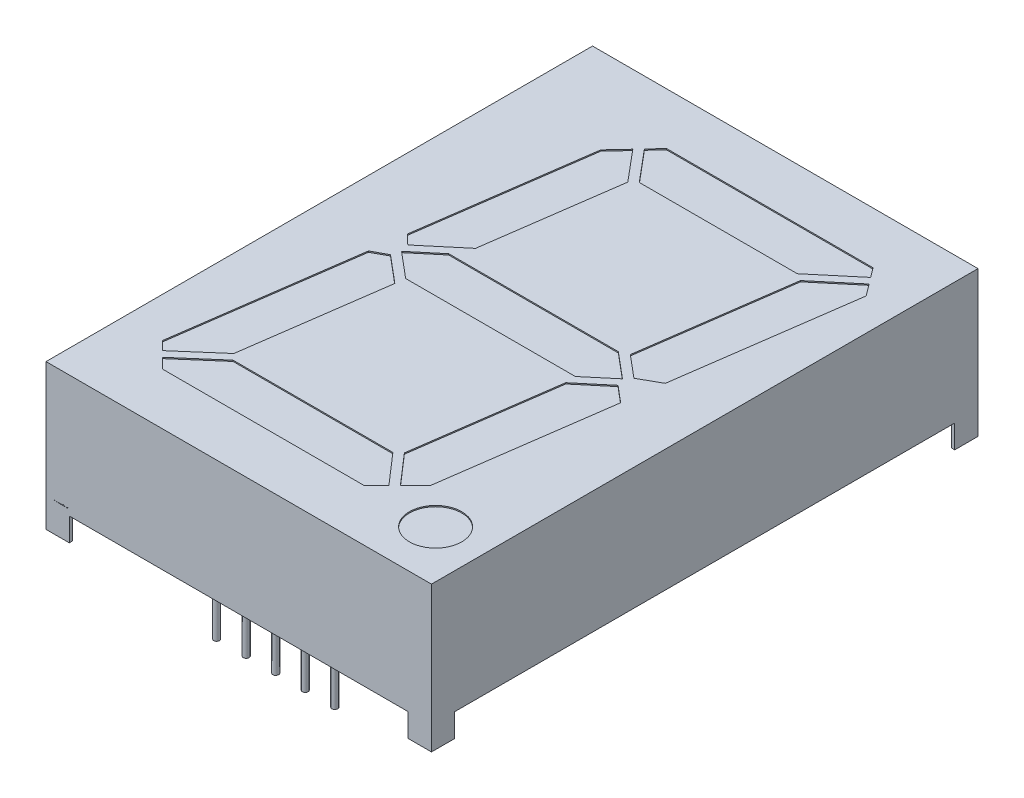
from build123d import *

# Parameters (mm, degrees)
SKETCH1_W          = 33.15
SKETCH1_H          = 47
EXTRUDE2_DEPTH     = 12.5
SKETCH2_W          = 14.575
SKETCH2_H          = 2
CUT_EXTRUDE2_DEPTH = 52.380741772
SKETCH3_W          = 43
SKETCH3_H          = 2
CUT_EXTRUDE3_DEPTH = 43.51379188
SKETCH6_R          = 2.25
CUT_EXTRUDE4_DEPTH = 0.1
SKETCH7_W          = 1.7
SKETCH7_H          = 1.7
CUT_EXTRUDE6_DEPTH = 2
SKETCH7_3_R        = 0.25
EXTRUDE3_DEPTH     = 2
EXTRUDE4_START     = 4
SKETCH7_4_R        = 0.25
SKETCH7_4_W        = 1.7
SKETCH7_4_H        = 1.7
EXTRUDE4_DEPTH     = 4
SKETCH8_W          = 0.007179487
SKETCH8_H          = 0.058461538
CUT_EXTRUDE7_DEPTH = 0.01


with BuildPart() as part:
    # Sketch1 → Extrude2 (new body)
    with BuildSketch(Plane(origin=(0, 0, 0), x_dir=(1, 0, 0), z_dir=(0, 1, 0))):
        Rectangle(SKETCH1_W, SKETCH1_H)
    extrude(amount=-EXTRUDE2_DEPTH)

    # Sketch2 → Cut-Extrude2 (cut, through all)
    with BuildSketch(Plane.XY.offset(23.5)):
        with Locations((-7.2875, -11.5)):
            Rectangle(SKETCH2_W, SKETCH2_H)
        with Locations((7.2875, -11.5)):
            Rectangle(SKETCH2_W, SKETCH2_H)
    extrude(amount=-CUT_EXTRUDE2_DEPTH, mode=Mode.SUBTRACT)

    # Sketch3 → Cut-Extrude3 (cut, through all)
    with BuildSketch(Plane(origin=(16.575, 0, 0), x_dir=(0, 0, -1), z_dir=(1, 0, 0))):
        with Locations((0, -11.5)):
            Rectangle(SKETCH3_W, SKETCH3_H)
    extrude(amount=-CUT_EXTRUDE3_DEPTH, mode=Mode.SUBTRACT)

    # Sketch6 → Cut-Extrude4 (cut)
    with BuildSketch(Plane(origin=(0, 0, 0), x_dir=(-1, 0, 0), z_dir=(0, 1, 0))):
        Polygon((7.159636452, -17.547385785), (8.486419468, -16.124585194), (10.536771025, -1.535575804), (9.704265607, -0.742385907), (6.538559998, -3.398728316), (4.924464858, -14.883612006), align=None)
        Polygon((5.758426028, -19.05), (6.678652418, -18.063178013), (4.402025748, -15.35), (-9.186935734, -15.35), (-12.617647052, -18.228708602), (-11.998759593, -19.05), align=None)
        Polygon((9.726495028, 0.723733208), (10.948594598, 1.394701177), (13.1317529, 16.928679656), (12.383658207, 17.676774349), (9.099274665, 14.821703294), (7.393105578, 2.681679435), align=None)
        Polygon((-7.295255854, -1.85), (7.295255854, -1.85), (9.5, 0), (7.295255854, 1.85), (-7.295255854, 1.85), (-9.5, 0), align=None)
        Polygon((-13.804204662, -16.65409347), (-13.039495697, -17.668896542), (-9.83223935, -14.977688924), (-8.029141607, -2.147981838), (-9.947047688, -0.538667552), (-11.675642691, -1.508588064), align=None)
        Polygon((8.640033345, 15.35), (11.887474783, 18.172957774), (11.010432556, 19.05), (-6.355403948, 19.05), (-7.407764203, 17.997639745), (-5.106206086, 15.35), align=None)
        Polygon((-9.789820201, 0.670597079), (-7.344664423, 2.72232639), (-5.634502792, 14.89075868), (-7.903947628, 17.50145632), (-9.183831073, 16.221572875), (-11.202176917, 1.860295969), align=None)
        with Locations(Location((-12.480210746, 19.05, 0), (0, 0, 90))):
            Circle(SKETCH6_R)
    extrude(amount=-CUT_EXTRUDE4_DEPTH, mode=Mode.SUBTRACT)

    # Sketch7 → Cut-Extrude6 (cut)
    with BuildSketch(Plane.XZ.offset(12.5)):
        with Locations((-15.425, 22.35)):
            Rectangle(SKETCH7_W, SKETCH7_H)
        with Locations((-15.425, -22.35)):
            Rectangle(SKETCH7_W, SKETCH7_H)
        with Locations((15.425, -22.35)):
            Rectangle(SKETCH7_W, SKETCH7_H)
        with Locations((15.425, 22.35)):
            Rectangle(SKETCH7_W, SKETCH7_H)
    extrude(amount=-CUT_EXTRUDE6_DEPTH, mode=Mode.SUBTRACT)

    # Sketch7<3> → Extrude3 (add)
    with BuildSketch(Plane.XZ.offset(12.5)):
        with Locations(Location((-5.08, 20.32, 0), (0, 0, 270))):
            Circle(SKETCH7_3_R)
        with Locations(Location((-2.54, 20.32, 0), (0, 0, 270))):
            Circle(SKETCH7_3_R)
        with Locations(Location((0, 20.32, 0), (0, 0, 270))):
            Circle(SKETCH7_3_R)
        with Locations(Location((5.08, 20.32, 0), (0, 0, 270))):
            Circle(SKETCH7_3_R)
        with Locations(Location((2.54, 20.32, 0), (0, 0, 270))):
            Circle(SKETCH7_3_R)
        with Locations(Location((2.54, -20.32, 0), (0, 0, 270))):
            Circle(SKETCH7_3_R)
        with Locations(Location((5.08, -20.32, 0), (0, 0, 270))):
            Circle(SKETCH7_3_R)
        with Locations(Location((0, -20.32, 0), (0, 0, 270))):
            Circle(SKETCH7_3_R)
        with Locations(Location((-2.54, -20.32, 0), (0, 0, 270))):
            Circle(SKETCH7_3_R)
        with Locations(Location((-5.08, -20.32, 0), (0, 0, 270))):
            Circle(SKETCH7_3_R)
    extrude(amount=-EXTRUDE3_DEPTH)

    # Sketch7<4> → Extrude4 (add)
    with BuildSketch(Plane.XZ.offset(12.5).offset(EXTRUDE4_START)):
        with Locations(Location((-5.08, 20.32, 0), (0, 0, 270))):
            Circle(SKETCH7_4_R)
        with Locations(Location((-2.54, 20.32, 0), (0, 0, 270))):
            Circle(SKETCH7_4_R)
        with Locations(Location((0, 20.32, 0), (0, 0, 270))):
            Circle(SKETCH7_4_R)
        with Locations(Location((5.08, 20.32, 0), (0, 0, 270))):
            Circle(SKETCH7_4_R)
        with Locations(Location((2.54, 20.32, 0), (0, 0, 270))):
            Circle(SKETCH7_4_R)
        with Locations(Location((2.54, -20.32, 0), (0, 0, 270))):
            Circle(SKETCH7_4_R)
        with Locations(Location((5.08, -20.32, 0), (0, 0, 270))):
            Circle(SKETCH7_4_R)
        with Locations(Location((0, -20.32, 0), (0, 0, 270))):
            Circle(SKETCH7_4_R)
        with Locations(Location((-2.54, -20.32, 0), (0, 0, 270))):
            Circle(SKETCH7_4_R)
        with Locations(Location((-5.08, -20.32, 0), (0, 0, 270))):
            Circle(SKETCH7_4_R)
        with Locations((-15.425, 22.35)):
            Rectangle(SKETCH7_4_W, SKETCH7_4_H)
        with Locations((-15.425, -22.35)):
            Rectangle(SKETCH7_4_W, SKETCH7_4_H)
        with Locations((15.425, -22.35)):
            Rectangle(SKETCH7_4_W, SKETCH7_4_H)
        with Locations((15.425, 22.35)):
            Rectangle(SKETCH7_4_W, SKETCH7_4_H)
    extrude(amount=-EXTRUDE4_DEPTH)


with BuildPart() as extrude4_kept_piece:
    # of the separate pieces the step leaves, the one the design keeps (extrude4_pieces_kept)
    add(part.part.solids().sort_by_distance((-16.575, 0, -23.5))[0])

    # Sketch8 → Cut-Extrude7 (cut)
    # profile 1 of 23: a face of its own
    with BuildSketch(Plane.XY.offset(23.5)):
        Polygon((-15.991666667, -9.941538462), (-15.983958333, -9.941538462), (-15.966538462, -9.983589744), (-15.947451923, -9.941538462), (-15.946233974, -9.941538462), (-15.927564103, -9.983589744), (-15.909983974, -9.941538462), (-15.902435897, -9.941538462), (-15.926875, -10), (-15.928365385, -10), (-15.947051282, -9.957948718), (-15.966121795, -10), (-15.967451923, -10), align=None)
    # profile 2 of 23: a face of its own
    with BuildSketch(Plane.XY.offset(23.5)):
        Polygon((-15.901410256, -9.941538462), (-15.893701923, -9.941538462), (-15.876282051, -9.983589744), (-15.857195513, -9.941538462), (-15.855977564, -9.941538462), (-15.837307692, -9.983589744), (-15.819727564, -9.941538462), (-15.812179487, -9.941538462), (-15.83661859, -10), (-15.838108974, -10), (-15.856794872, -9.957948718), (-15.875865385, -10), (-15.877195513, -10), align=None)
    # profile 3 of 23: a face of its own
    with BuildSketch(Plane.XY.offset(23.5)):
        Polygon((-15.811153846, -9.941538462), (-15.803445513, -9.941538462), (-15.786025641, -9.983589744), (-15.766939103, -9.941538462), (-15.765721154, -9.941538462), (-15.747051282, -9.983589744), (-15.729471154, -9.941538462), (-15.721923077, -9.941538462), (-15.746362179, -10), (-15.747852564, -10), (-15.766538462, -9.957948718), (-15.785608974, -10), (-15.786939103, -10), align=None)
    # profile 4 of 23: a face of its own
    with BuildSketch(Plane.XY.offset(23.5)):
        with BuildLine():
            add(Edge.make_bspline(
                [(-15.705, -9.987692308), (-15.704554509, -9.98771878), (-15.703681177, -9.987770676), (-15.702418569, -9.988126714), (-15.701275834, -9.988758912), (-15.700257954, -9.98960149), (-15.699418948, -9.990623105), (-15.69876422, -9.991756726), (-15.698411284, -9.993029905), (-15.698359766, -9.993908298), (-15.698333333, -9.994358974)],
                knots=[0, 0, 0, 0, 1.020151414, 1.999887582, 2.974338812, 3.990962822, 5.007586832, 5.987933904, 6.967670073, 8, 8, 8, 8], degree=3))
            add(Edge.make_bspline(
                [(-15.698333333, -9.994358974), (-15.698360661, -9.994798822), (-15.698414552, -9.995666195), (-15.698763411, -9.996929771), (-15.699423938, -9.9980641), (-15.700252167, -9.999099578), (-15.701276085, -9.999943941), (-15.70242127, -10.00057076), (-15.703678213, -10.000952291), (-15.704554015, -10.001000892), (-15.705, -10.001025641)],
                knots=[0, 0, 0, 0, 1.009421747, 1.99056486, 2.972319754, 3.999869655, 5.017953583, 5.993804169, 6.978383603, 8, 8, 8, 8], degree=3))
            add(Edge.make_bspline(
                [(-15.705, -10.001025641), (-15.705446306, -10.001001787), (-15.706317613, -10.000955219), (-15.707569865, -10.000562926), (-15.708722024, -9.999949818), (-15.709745743, -9.999098003), (-15.710580908, -9.998069429), (-15.711212346, -9.996921959), (-15.711591549, -9.995669812), (-15.71164142, -9.994799534), (-15.711666667, -9.994358974)],
                knots=[0, 0, 0, 0, 1.022052826, 1.995314843, 2.982371812, 4.00089066, 5.028879526, 6.005146991, 6.990147033, 8, 8, 8, 8], degree=3))
            add(Edge.make_bspline(
                [(-15.711666667, -9.994358974), (-15.71164239, -9.99390756), (-15.711594993, -9.993026229), (-15.711211549, -9.991764535), (-15.710585807, -9.990617828), (-15.70973997, -9.989603049), (-15.708722272, -9.988753053), (-15.707572644, -9.988134429), (-15.706314597, -9.987767791), (-15.705445799, -9.987717905), (-15.705, -9.987692308)],
                knots=[0, 0, 0, 0, 1.032775665, 2.016367738, 2.991239715, 4.008302682, 5.025365648, 6.011011707, 6.979408107, 8, 8, 8, 8], degree=3))
        make_face()
    # profile 5 of 23: a face of its own
    with BuildSketch(Plane.XY.offset(23.5)):
        Polygon((-15.680897436, -9.92), (-15.673717949, -9.92), (-15.673717949, -9.950464744), (-15.64036859, -9.92), (-15.630128205, -9.92), (-15.669439103, -9.955897436), (-15.627051282, -10), (-15.63661859, -10), (-15.673717949, -9.961394231), (-15.673717949, -10), (-15.680897436, -10), align=None)
    # profile 6 of 23: a face of its own
    with BuildSketch(Plane.XY.offset(23.5)):
        with BuildLine():
            add(Edge.make_bspline(
                [(-15.614775641, -9.916923077), (-15.614330125, -9.916943743), (-15.61345772, -9.916984212), (-15.612196159, -9.91733076), (-15.611047428, -9.917918181), (-15.610028508, -9.918706288), (-15.609154179, -9.919633133), (-15.608542049, -9.920713383), (-15.608148622, -9.921880438), (-15.608101113, -9.922694497), (-15.608076923, -9.923108974)],
                knots=[0, 0, 0, 0, 1.055194115, 2.066272739, 3.074728998, 4.095836921, 5.109056067, 6.073838105, 7.019297344, 8, 8, 8, 8], degree=3))
            add(Edge.make_bspline(
                [(-15.608076923, -9.923108974), (-15.608101658, -9.923512692), (-15.608150556, -9.924310794), (-15.608541745, -9.925457617), (-15.609159396, -9.926522857), (-15.610027947, -9.927447902), (-15.611047576, -9.928235574), (-15.61219612, -9.92882311), (-15.61345773, -9.929169628), (-15.614330129, -9.929210101), (-15.614775641, -9.929230769)],
                knots=[0, 0, 0, 0, 0.96129708, 1.900370562, 2.859976407, 3.87933698, 4.906634145, 5.921202961, 6.938410037, 8, 8, 8, 8], degree=3))
            add(Edge.make_bspline(
                [(-15.614775641, -9.929230769), (-15.615216059, -9.92921089), (-15.616073274, -9.929172197), (-15.617315945, -9.928816311), (-15.618454882, -9.928235372), (-15.619475789, -9.92745306), (-15.620326765, -9.926517176), (-15.620946155, -9.925458267), (-15.62133644, -9.924310629), (-15.62138546, -9.923512637), (-15.621410256, -9.923108974)],
                knots=[0, 0, 0, 0, 1.054934014, 2.053291228, 3.073705704, 4.106921865, 5.123545215, 6.088680038, 7.033164197, 8, 8, 8, 8], degree=3))
            add(Edge.make_bspline(
                [(-15.621410256, -9.923108974), (-15.621386003, -9.922694555), (-15.621338368, -9.921880609), (-15.620945862, -9.920712723), (-15.620331924, -9.91963886), (-15.619475225, -9.918701134), (-15.618455032, -9.917918381), (-15.617315906, -9.917337559), (-15.616073285, -9.916981642), (-15.615216062, -9.916942954), (-15.614775641, -9.916923077)],
                knots=[0, 0, 0, 0, 0.98631895, 1.937192651, 2.907499808, 3.917963147, 4.944918757, 5.95915025, 6.951458133, 8, 8, 8, 8], degree=3))
        make_face()
    # profile 7 of 23: a face of its own
    with BuildSketch(Plane.XY.offset(23.5)):
        with Locations((-15.61474359, -9.970769231)):
            Rectangle(SKETCH8_W, SKETCH8_H)
    # profile 8 of 23: a face of its own
    with BuildSketch(Plane.XY.offset(23.5)):
        with BuildLine():
            Line((-15.593717949, -9.941538462), (-15.586538462, -9.941538462))
            Line((-15.586538462, -9.941538462), (-15.586538462, -9.952083333))
            add(Edge.make_bspline(
                [(-15.586538462, -9.952083333), (-15.585771887, -9.951126928), (-15.584284322, -9.949270991), (-15.581806966, -9.946831663), (-15.57918882, -9.944821487), (-15.576445917, -9.943219114), (-15.573574534, -9.942011191), (-15.570592173, -9.941138827), (-15.56748098, -9.940615746), (-15.565365222, -9.940547397), (-15.564294872, -9.940512821)],
                knots=[0, 0, 0, 0, 1.12780773, 2.188550248, 3.19190651, 4.159438251, 5.104880172, 6.052711206, 7.014878035, 8, 8, 8, 8], degree=3))
            add(Edge.make_bspline(
                [(-15.564294872, -9.940512821), (-15.563213029, -9.940552711), (-15.561095601, -9.940630785), (-15.558012674, -9.94124831), (-15.555133282, -9.942303058), (-15.552467692, -9.943747906), (-15.550064784, -9.945544625), (-15.547954502, -9.947637832), (-15.546209056, -9.950045514), (-15.545038831, -9.952279186), (-15.544267959, -9.954260644), (-15.543782648, -9.955957712), (-15.543370512, -9.957848413), (-15.543013215, -9.959927032), (-15.542771452, -9.962208134), (-15.542580771, -9.964682367), (-15.542444115, -9.96734893), (-15.542438693, -9.969193195), (-15.542435897, -9.970144231)],
                knots=[0, 0, 0, 0, 1.235846778, 2.418850247, 3.575807741, 4.728682307, 5.871620074, 6.994088408, 8.11269785, 9.256955736, 9.865816715, 10.540099792, 11.271859618, 12.076849838, 12.949306005, 13.892391288, 14.913166135, 16, 16, 16, 16], degree=3))
            Line((-15.542435897, -9.970144231), (-15.542435897, -10))
            Line((-15.542435897, -10), (-15.549615385, -10))
            Line((-15.549615385, -10), (-15.549615385, -9.9725))
            add(Edge.make_bspline(
                [(-15.549615385, -9.9725), (-15.549619801, -9.971704058), (-15.549628248, -9.970181558), (-15.549654892, -9.968001694), (-15.549719116, -9.966024858), (-15.549809363, -9.964255775), (-15.549941455, -9.962696145), (-15.550079115, -9.96134279), (-15.550247457, -9.960197429), (-15.550397467, -9.959507941), (-15.550464744, -9.959198718)],
                knots=[0, 0, 0, 0, 1.430800155, 2.736877192, 3.918605307, 4.986035426, 5.920637409, 6.731861385, 7.431261377, 8, 8, 8, 8], degree=3))
            add(Edge.make_bspline(
                [(-15.550464744, -9.959198718), (-15.550707613, -9.958291034), (-15.551175061, -9.956544022), (-15.552330124, -9.954174323), (-15.553788733, -9.952158364), (-15.555569256, -9.950508611), (-15.557654492, -9.949224706), (-15.560038655, -9.948333873), (-15.562698738, -9.947776701), (-15.564569696, -9.947721223), (-15.565544872, -9.947692308)],
                knots=[0, 0, 0, 0, 1.084156227, 2.086665306, 3.027808233, 3.945421172, 4.874247719, 5.839848303, 6.874090471, 8, 8, 8, 8], degree=3))
            add(Edge.make_bspline(
                [(-15.565544872, -9.947692308), (-15.566122419, -9.947703188), (-15.56726537, -9.947724719), (-15.568960226, -9.947940749), (-15.570604207, -9.948294085), (-15.572213812, -9.948771082), (-15.573756847, -9.94942622), (-15.575282888, -9.950169749), (-15.576734471, -9.951096565), (-15.578142549, -9.952129493), (-15.579452556, -9.953274161), (-15.580671489, -9.954482035), (-15.581758073, -9.955768335), (-15.5827425, -9.957112334), (-15.583592289, -9.95853249), (-15.584334073, -9.960015103), (-15.584963461, -9.961562123), (-15.585276208, -9.962635839), (-15.585432692, -9.963173077)],
                knots=[0, 0, 0, 0, 1.023777757, 2.026029729, 3.023749952, 4.003683103, 4.997618607, 5.993177895, 7.010360494, 8.046726602, 9.087585522, 10.09234134, 11.086953743, 12.070360549, 13.043493632, 14.017870808, 15.008233677, 16, 16, 16, 16], degree=3))
            add(Edge.make_bspline(
                [(-15.585432692, -9.963173077), (-15.585522741, -9.963567482), (-15.585718774, -9.96442608), (-15.585930503, -9.965835095), (-15.586122677, -9.967465037), (-15.586283521, -9.969314005), (-15.586381931, -9.97138847), (-15.586489231, -9.973679575), (-15.586528296, -9.976196455), (-15.586534978, -9.977948722), (-15.586538462, -9.978862179)],
                knots=[0, 0, 0, 0, 0.615963638, 1.340920617, 2.168419149, 3.115676021, 4.16674242, 5.331190069, 6.6087489, 8, 8, 8, 8], degree=3))
            Line((-15.586538462, -9.978862179), (-15.586538462, -10))
            Line((-15.586538462, -10), (-15.593717949, -10))
            Line((-15.593717949, -10), (-15.593717949, -9.941538462))
        make_face()
    # profile 9 of 23: a face of its own
    with BuildSketch(Plane.XY.offset(23.5)):
        with BuildLine():
            Line((-15.47474359, -9.941538462), (-15.467564103, -9.941538462))
            Line((-15.467564103, -9.941538462), (-15.467564103, -9.987932692))
            add(Edge.make_bspline(
                [(-15.467564103, -9.987932692), (-15.467570435, -9.98892098), (-15.467582658, -9.990828614), (-15.46767068, -9.993586975), (-15.467856296, -9.996134771), (-15.46806678, -9.998483622), (-15.468369562, -10.000622642), (-15.468739307, -10.002558212), (-15.469156123, -10.004292191), (-15.469522299, -10.005360187), (-15.469695513, -10.005865385)],
                knots=[0, 0, 0, 0, 1.307562039, 2.523909702, 3.650326591, 4.686913197, 5.643429486, 6.506965704, 7.293745905, 8, 8, 8, 8], degree=3))
            add(Edge.make_bspline(
                [(-15.469695513, -10.005865385), (-15.469951267, -10.006522069), (-15.470455128, -10.007815802), (-15.4713988, -10.009649729), (-15.472455575, -10.011376504), (-15.473662586, -10.012986503), (-15.475014376, -10.014471644), (-15.476479096, -10.015864192), (-15.478085271, -10.017134687), (-15.479831985, -10.018261209), (-15.481678971, -10.01927577), (-15.483625167, -10.020154548), (-15.4856596, -10.020919962), (-15.487801381, -10.021493283), (-15.490016929, -10.021990077), (-15.492332299, -10.022313384), (-15.494733963, -10.022533431), (-15.496367, -10.022553779), (-15.497195513, -10.022564103)],
                knots=[0, 0, 0, 0, 0.981931301, 1.934503488, 2.87077864, 3.801706999, 4.735015492, 5.667491629, 6.616593066, 7.585388521, 8.561939025, 9.551802639, 10.560317337, 11.588439944, 12.640189604, 13.723962949, 14.845264515, 16, 16, 16, 16], degree=3))
            add(Edge.make_bspline(
                [(-15.497195513, -10.022564103), (-15.498404307, -10.022544526), (-15.500765406, -10.022506287), (-15.504207806, -10.02206078), (-15.507477171, -10.021430966), (-15.510530301, -10.020477699), (-15.513347904, -10.019311139), (-15.515910735, -10.017971826), (-15.518195789, -10.016436071), (-15.520255759, -10.014687485), (-15.522114995, -10.012608316), (-15.52386419, -10.010158056), (-15.525547869, -10.007299384), (-15.526534581, -10.005201265), (-15.527051282, -10.004102564)],
                knots=[0, 0, 0, 0, 1.157897085, 2.2616841, 3.32207898, 4.345638746, 5.321241055, 6.241986252, 7.112515963, 7.955008012, 8.825025602, 9.77857164, 10.836726669, 12, 12, 12, 12], degree=3))
            Line((-15.527051282, -10.004102564), (-15.519871795, -10.004102564))
            add(Edge.make_bspline(
                [(-15.519871795, -10.004102564), (-15.519294373, -10.00501927), (-15.518165584, -10.006811317), (-15.516054762, -10.009131617), (-15.513741474, -10.011114551), (-15.511147653, -10.012712512), (-15.508262505, -10.013917307), (-15.505084295, -10.014776171), (-15.501587161, -10.015290372), (-15.499152459, -10.015352344), (-15.497884615, -10.015384615)],
                knots=[0, 0, 0, 0, 0.997731894, 1.950442991, 2.880492273, 3.800895997, 4.748200782, 5.754801363, 6.83083817, 8, 8, 8, 8], degree=3))
            add(Edge.make_bspline(
                [(-15.497884615, -10.015384615), (-15.496632801, -10.015351926), (-15.494219427, -10.015288905), (-15.490749001, -10.014775942), (-15.487581116, -10.01391712), (-15.484734026, -10.012714643), (-15.482241323, -10.011241491), (-15.480092477, -10.009595775), (-15.478352028, -10.007740209), (-15.477181445, -10.006030911), (-15.476453797, -10.004508073), (-15.475990432, -10.003197157), (-15.475613884, -10.001714805), (-15.475298916, -10.000065988), (-15.475039009, -9.998248351), (-15.474874372, -9.996257736), (-15.474755382, -9.994098668), (-15.474747611, -9.992601682), (-15.47474359, -9.991826923)],
                knots=[0, 0, 0, 0, 1.570740765, 3.028230971, 4.391408896, 5.680370741, 6.894727393, 8.017376726, 9.065722033, 10.075533815, 10.603371122, 11.180248986, 11.817768598, 12.521299649, 13.286540596, 14.121245857, 15.027658897, 16, 16, 16, 16], degree=3))
            Line((-15.47474359, -9.991826923), (-15.47474359, -9.988798077))
            add(Edge.make_bspline(
                [(-15.47474359, -9.988798077), (-15.475472301, -9.989665318), (-15.476916906, -9.991384546), (-15.479411702, -9.993637383), (-15.48213666, -9.995577638), (-15.485087141, -9.997168921), (-15.488190872, -9.998441639), (-15.491414237, -9.999331764), (-15.494728341, -9.999906847), (-15.496974105, -9.999968729), (-15.498108974, -10)],
                knots=[0, 0, 0, 0, 1.012485704, 2.007162095, 2.997754123, 3.998611389, 4.999708251, 5.992315798, 6.98544096, 8, 8, 8, 8], degree=3))
            add(Edge.make_bspline(
                [(-15.498108974, -10), (-15.498777232, -9.999988228), (-15.500105839, -9.999964823), (-15.502079662, -9.999760051), (-15.504024358, -9.999462937), (-15.505935391, -9.99902679), (-15.507815519, -9.998466979), (-15.509661635, -9.997767168), (-15.511488687, -9.996975965), (-15.513263465, -9.996044015), (-15.51496829, -9.995007163), (-15.516590306, -9.993883988), (-15.518121016, -9.99268037), (-15.51954585, -9.99138444), (-15.520862939, -9.989998073), (-15.522089999, -9.988536049), (-15.523206738, -9.986977952), (-15.524236073, -9.985352193), (-15.525128817, -9.983647944), (-15.52591246, -9.981902159), (-15.526593818, -9.980118571), (-15.527137027, -9.97829121), (-15.527551909, -9.976421226), (-15.527860715, -9.974511685), (-15.528035867, -9.972556704), (-15.52806318, -9.971239645), (-15.528076923, -9.970576923)],
                knots=[0, 0, 0, 0, 1.028754217, 2.045334182, 3.052854819, 4.056607503, 5.061168794, 6.071104265, 7.095078842, 8.125279047, 9.155117945, 10.165957491, 11.161587969, 12.151493252, 13.128948131, 14.104219989, 15.088194871, 16.07871515, 17.064853787, 18.047899887, 19.02414258, 20.002704429, 20.980574569, 21.971845993, 22.979467364, 24, 24, 24, 24], degree=3))
            add(Edge.make_bspline(
                [(-15.528076923, -9.970576923), (-15.528065056, -9.969913995), (-15.528041369, -9.968590707), (-15.527836775, -9.96662775), (-15.527544931, -9.964691077), (-15.527083039, -9.962800651), (-15.526527096, -9.960934942), (-15.525838557, -9.959107732), (-15.5250107, -9.957318463), (-15.524073334, -9.955565811), (-15.523019983, -9.953873294), (-15.521864955, -9.952265828), (-15.520606855, -9.950755241), (-15.51926304, -9.949326294), (-15.517817101, -9.947992774), (-15.516269787, -9.946757918), (-15.51463635, -9.945601026), (-15.512911727, -9.944547052), (-15.511122529, -9.943614887), (-15.509314214, -9.942764313), (-15.507462825, -9.942089248), (-15.505602882, -9.941494434), (-15.503701626, -9.941073058), (-15.501782372, -9.940747978), (-15.499838547, -9.940549927), (-15.498536766, -9.940525205), (-15.497884615, -9.940512821)],
                knots=[0, 0, 0, 0, 1.008818848, 2.013730394, 3.001654427, 3.987803273, 4.973046549, 5.963777569, 6.957074694, 7.972068341, 8.987420212, 9.989399531, 10.982630087, 11.977756091, 12.973280677, 13.973972381, 14.989194003, 16.018387222, 17.047741039, 18.059210846, 19.057554164, 20.045176975, 21.029480261, 22.018708529, 23.007435371, 24, 24, 24, 24], degree=3))
            add(Edge.make_bspline(
                [(-15.497884615, -9.940512821), (-15.496809165, -9.94054383), (-15.494685482, -9.940605065), (-15.491560202, -9.941085548), (-15.488544379, -9.941851583), (-15.485620996, -9.942949083), (-15.482766238, -9.944447369), (-15.479989515, -9.946420922), (-15.477282792, -9.948887445), (-15.475612441, -9.950778939), (-15.47474359, -9.951762821)],
                knots=[0, 0, 0, 0, 0.96728863, 1.910097829, 2.838038873, 3.762875196, 4.71315279, 5.730631239, 6.819562287, 8, 8, 8, 8], degree=3))
            Line((-15.47474359, -9.951762821), (-15.47474359, -9.941538462))
        make_face()
        with BuildLine():
            add(Edge.make_bspline(
                [(-15.497307692, -9.947692308), (-15.498357537, -9.947727989), (-15.500436007, -9.947798631), (-15.503482597, -9.94840171), (-15.506423785, -9.949346759), (-15.509203337, -9.95069859), (-15.511806928, -9.952346459), (-15.51411721, -9.954342808), (-15.516137894, -9.956622721), (-15.517847218, -9.959165584), (-15.519207935, -9.96190895), (-15.520171213, -9.964800624), (-15.520794071, -9.967793881), (-15.520862817, -9.969836684), (-15.520897436, -9.970865385)],
                knots=[0, 0, 0, 0, 1.026226791, 2.031711442, 3.026614839, 4.04107745, 5.047145931, 6.032893242, 7.017642609, 8.019221815, 9.021877557, 10.003543541, 10.994637589, 12, 12, 12, 12], degree=3))
            add(Edge.make_bspline(
                [(-15.520897436, -9.970865385), (-15.520880847, -9.971641002), (-15.520848222, -9.973166415), (-15.52053454, -9.975404996), (-15.520027547, -9.977537117), (-15.519308982, -9.979562909), (-15.518418635, -9.98149399), (-15.517298809, -9.983317058), (-15.515981073, -9.985033737), (-15.514475739, -9.98663133), (-15.51281685, -9.988086438), (-15.511017554, -9.989365021), (-15.509080292, -9.990410752), (-15.507052707, -9.991314543), (-15.504885604, -9.991974636), (-15.502610197, -9.992478379), (-15.500210386, -9.992766579), (-15.498574461, -9.9928023), (-15.497740385, -9.992820513)],
                knots=[0, 0, 0, 0, 1.039728707, 2.044842319, 3.024901384, 3.974314358, 4.923051295, 5.871625912, 6.837440708, 7.820715446, 8.810779094, 9.792721783, 10.773906224, 11.758876063, 12.764959493, 13.806266761, 14.881525401, 16, 16, 16, 16], degree=3))
            add(Edge.make_bspline(
                [(-15.497740385, -9.992820513), (-15.496895499, -9.992802967), (-15.495243333, -9.992768658), (-15.492830283, -9.992473721), (-15.490543821, -9.99199779), (-15.488386042, -9.991322063), (-15.4863488, -9.990459852), (-15.48445498, -9.989368729), (-15.482663976, -9.988126114), (-15.481032972, -9.986676696), (-15.479558134, -9.985079325), (-15.478272859, -9.983341156), (-15.477177672, -9.981488344), (-15.476270754, -9.979521098), (-15.475578383, -9.97742413), (-15.475113951, -9.975202682), (-15.474789225, -9.972867397), (-15.474759033, -9.9712672), (-15.47474359, -9.970448718)],
                knots=[0, 0, 0, 0, 1.121943988, 2.193949579, 3.223793937, 4.220241907, 5.192961521, 6.155822191, 7.11847367, 8.083710714, 9.04790392, 10.001595906, 10.949595423, 11.902125208, 12.873731292, 13.87582262, 14.913508608, 16, 16, 16, 16], degree=3))
            add(Edge.make_bspline(
                [(-15.47474359, -9.970448718), (-15.474774208, -9.969383167), (-15.474834027, -9.967301455), (-15.475398533, -9.964268157), (-15.476308709, -9.961416302), (-15.477585207, -9.958754908), (-15.479184795, -9.956312176), (-15.481111443, -9.954133345), (-15.483331924, -9.952215611), (-15.485839858, -9.950617938), (-15.488538085, -9.9493273), (-15.491361427, -9.94835903), (-15.494305691, -9.947810589), (-15.496301266, -9.947731962), (-15.497307692, -9.947692308)],
                knots=[0, 0, 0, 0, 1.070913519, 2.092188694, 3.091357305, 4.074328408, 5.051968682, 6.018948707, 6.99050112, 7.9935919, 9.000589572, 9.992915277, 10.987769056, 12, 12, 12, 12], degree=3))
        make_face(mode=Mode.SUBTRACT)
    # profile 10 of 23: a face of its own
    with BuildSketch(Plane.XY.offset(23.5)):
        with BuildLine():
            Line((-15.451153846, -10), (-15.451153846, -9.917948718))
            Line((-15.451153846, -9.917948718), (-15.443974359, -9.917948718))
            Line((-15.443974359, -9.917948718), (-15.443974359, -9.952147436))
            add(Edge.make_bspline(
                [(-15.443974359, -9.952147436), (-15.443165367, -9.951215826), (-15.441586989, -9.949398217), (-15.43894067, -9.947024556), (-15.436165686, -9.945011928), (-15.433240925, -9.943352817), (-15.43016223, -9.94208942), (-15.426945496, -9.94116548), (-15.423582501, -9.940608065), (-15.421289491, -9.94054484), (-15.420128205, -9.940512821)],
                knots=[0, 0, 0, 0, 1.077089805, 2.101446609, 3.097517232, 4.067117542, 5.031729543, 5.997785507, 6.985986182, 8, 8, 8, 8], degree=3))
            add(Edge.make_bspline(
                [(-15.420128205, -9.940512821), (-15.419095836, -9.940541169), (-15.417054667, -9.940597218), (-15.414053932, -9.941023149), (-15.411166772, -9.941713841), (-15.408394757, -9.942671377), (-15.405750822, -9.943941845), (-15.40321233, -9.945462789), (-15.400792284, -9.947273951), (-15.398528173, -9.94934477), (-15.396441455, -9.951592921), (-15.394614884, -9.953997042), (-15.393072033, -9.956522187), (-15.39179589, -9.959159903), (-15.390809123, -9.961920963), (-15.390129299, -9.964802659), (-15.389697449, -9.967802156), (-15.389643043, -9.969843592), (-15.389615385, -9.97088141)],
                knots=[0, 0, 0, 0, 1.034377878, 2.045141349, 3.03070803, 4.00595497, 4.978199603, 5.965204761, 6.967410914, 8.002051993, 9.036360596, 10.037508045, 11.022711142, 11.997267194, 12.969246472, 13.954813154, 14.960274251, 16, 16, 16, 16], degree=3))
            add(Edge.make_bspline(
                [(-15.389615385, -9.97088141), (-15.389643646, -9.971903125), (-15.389699373, -9.973917785), (-15.390125003, -9.976882507), (-15.390827775, -9.979735963), (-15.391832602, -9.98247078), (-15.393095801, -9.985099807), (-15.394675487, -9.987593073), (-15.396499738, -9.989993964), (-15.398610165, -9.992225361), (-15.400893903, -9.994287839), (-15.403337657, -9.996079973), (-15.405879872, -9.997627793), (-15.408560172, -9.998854203), (-15.41133887, -9.999846224), (-15.414245736, -10.000534628), (-15.417264324, -10.000936298), (-15.419315042, -10.000995626), (-15.420352564, -10.001025641)],
                knots=[0, 0, 0, 0, 1.024244038, 2.01964794, 2.996620209, 3.965911562, 4.936179293, 5.91563013, 6.920572822, 7.955171681, 8.990768464, 10.002129126, 10.989675881, 11.969873457, 12.952483066, 13.943799762, 14.959703725, 16, 16, 16, 16], degree=3))
            add(Edge.make_bspline(
                [(-15.420352564, -10.001025641), (-15.421540338, -10.000992713), (-15.423869356, -10.000928146), (-15.427276274, -10.000392855), (-15.430500995, -9.999481733), (-15.433580253, -9.998257464), (-15.43647003, -9.996599666), (-15.439188672, -9.994543512), (-15.441719034, -9.99205512), (-15.443209705, -9.990156572), (-15.443974359, -9.989182692)],
                knots=[0, 0, 0, 0, 1.035807596, 2.031038093, 2.998900396, 3.954262848, 4.914341711, 5.895762244, 6.92060972, 8, 8, 8, 8], degree=3))
            Line((-15.443974359, -9.989182692), (-15.443974359, -10))
            Line((-15.443974359, -10), (-15.451153846, -10))
        make_face()
        with BuildLine():
            add(Edge.make_bspline(
                [(-15.420416667, -9.993846154), (-15.419367196, -9.993808814), (-15.417295707, -9.99373511), (-15.414254706, -9.993159713), (-15.411344667, -9.992202362), (-15.408580254, -9.99089302), (-15.406004727, -9.989246802), (-15.403704095, -9.98725489), (-15.401658845, -9.984980569), (-15.399952518, -9.982415228), (-15.398527918, -9.97968492), (-15.397549329, -9.976812822), (-15.396892878, -9.973875798), (-15.396827683, -9.971883888), (-15.396794872, -9.97088141)],
                knots=[0, 0, 0, 0, 1.031910345, 2.036826888, 3.032245421, 4.038315463, 5.03827337, 6.029480047, 7.023177075, 8.037597977, 9.052889626, 10.043399556, 11.015292101, 12, 12, 12, 12], degree=3))
            add(Edge.make_bspline(
                [(-15.396794872, -9.97088141), (-15.39683802, -9.969879912), (-15.396924145, -9.967880914), (-15.397526997, -9.964917493), (-15.398579746, -9.962046919), (-15.39997673, -9.959277136), (-15.401710855, -9.956694101), (-15.403745277, -9.954374327), (-15.406074004, -9.952372956), (-15.408652825, -9.950704611), (-15.411399801, -9.94934325), (-15.414291016, -9.948409649), (-15.417266058, -9.947798491), (-15.419286527, -9.947727882), (-15.420304487, -9.947692308)],
                knots=[0, 0, 0, 0, 0.984795267, 1.965658976, 2.959410029, 3.983795688, 5.009594896, 6.01088574, 7.009236619, 8.019050059, 9.024672985, 10.014834719, 10.999826153, 12, 12, 12, 12], degree=3))
            add(Edge.make_bspline(
                [(-15.420304487, -9.947692308), (-15.421343744, -9.947727862), (-15.423406459, -9.94779843), (-15.426450304, -9.948410723), (-15.42942318, -9.949348954), (-15.432264037, -9.950695956), (-15.43491213, -9.952344218), (-15.437280418, -9.954281137), (-15.439322283, -9.956493249), (-15.441003283, -9.958973382), (-15.44233825, -9.961651897), (-15.443293307, -9.964509319), (-15.443864727, -9.967530606), (-15.44393737, -9.969602222), (-15.443974359, -9.970657051)],
                knots=[0, 0, 0, 0, 1.016820015, 2.018181405, 3.029022337, 4.06341356, 5.088169224, 6.076823655, 7.05054209, 8.02560866, 9.001194327, 9.972267242, 10.967515442, 12, 12, 12, 12], degree=3))
            add(Edge.make_bspline(
                [(-15.443974359, -9.970657051), (-15.443952424, -9.971464773), (-15.443909248, -9.973054624), (-15.443579411, -9.975388972), (-15.44305471, -9.977622871), (-15.44231543, -9.979758757), (-15.441343973, -9.981784504), (-15.440173453, -9.983715843), (-15.438780273, -9.985535346), (-15.437205265, -9.987238554), (-15.435468982, -9.988788483), (-15.433605596, -9.990131985), (-15.431653186, -9.991288881), (-15.429589416, -9.992211049), (-15.427438301, -9.992963655), (-15.425177767, -9.993460426), (-15.422830992, -9.993802713), (-15.421229915, -9.993831521), (-15.420416667, -9.993846154)],
                knots=[0, 0, 0, 0, 1.050331198, 2.067384183, 3.060053655, 4.031335885, 5.001026174, 5.976994447, 6.963687968, 7.976578778, 8.990422448, 9.985569286, 10.960374351, 11.936812464, 12.921228065, 13.919088064, 14.943024695, 16, 16, 16, 16], degree=3))
        make_face(mode=Mode.SUBTRACT)
    # profile 11 of 23: a face of its own
    with BuildSketch(Plane.XY.offset(23.5)):
        with BuildLine():
            Line((-15.377307692, -9.941538462), (-15.370128205, -9.941538462))
            Line((-15.370128205, -9.941538462), (-15.370128205, -9.950144231))
            add(Edge.make_bspline(
                [(-15.370128205, -9.950144231), (-15.369598176, -9.949342955), (-15.3685845, -9.94781052), (-15.366899633, -9.945783794), (-15.365173843, -9.944105735), (-15.363398867, -9.942768512), (-15.361561654, -9.941767069), (-15.359702523, -9.941033514), (-15.357792227, -9.940599747), (-15.356508526, -9.940541835), (-15.355865385, -9.940512821)],
                knots=[0, 0, 0, 0, 1.2804753, 2.448899062, 3.506932113, 4.484331642, 5.4025378, 6.288909075, 7.142734305, 8, 8, 8, 8], degree=3))
            add(Edge.make_bspline(
                [(-15.355865385, -9.940512821), (-15.355366497, -9.940540033), (-15.354340004, -9.940596023), (-15.352786116, -9.940989413), (-15.351185123, -9.941617482), (-15.350153297, -9.942208116), (-15.349615385, -9.942516026)],
                knots=[0, 0, 0, 0, 0.901110191, 1.854092781, 2.881294221, 4, 4, 4, 4], degree=3))
            Line((-15.349615385, -9.942516026), (-15.353557692, -9.948733974))
            add(Edge.make_bspline(
                [(-15.353557692, -9.948733974), (-15.353903041, -9.948579911), (-15.35455858, -9.94828747), (-15.355517541, -9.947941367), (-15.356401686, -9.947737574), (-15.356964968, -9.947706701), (-15.357227564, -9.947692308)],
                knots=[0, 0, 0, 0, 1.180555205, 2.24091978, 3.179933427, 4, 4, 4, 4], degree=3))
            add(Edge.make_bspline(
                [(-15.357227564, -9.947692308), (-15.357803695, -9.947730709), (-15.358978835, -9.947809035), (-15.360704195, -9.948424779), (-15.362378417, -9.949419642), (-15.363708055, -9.950522982), (-15.364737593, -9.951586931), (-15.365472226, -9.952516038), (-15.366146118, -9.953557835), (-15.366790008, -9.954694513), (-15.367376667, -9.955945481), (-15.367924202, -9.957298241), (-15.368419262, -9.958754358), (-15.368701553, -9.959768815), (-15.368846154, -9.960288462)],
                knots=[0, 0, 0, 0, 1.125678352, 2.296057538, 3.5422874, 4.923748041, 5.663163013, 6.437101912, 7.23742474, 8.08941207, 8.991984279, 9.93940061, 10.944477711, 12, 12, 12, 12], degree=3))
            add(Edge.make_bspline(
                [(-15.368846154, -9.960288462), (-15.368954323, -9.96075194), (-15.369193909, -9.961778509), (-15.369426858, -9.963500761), (-15.369657019, -9.965535587), (-15.369819227, -9.967888652), (-15.369969582, -9.97055408), (-15.370054384, -9.97353593), (-15.370125313, -9.976837264), (-15.370127212, -9.979145249), (-15.370128205, -9.980352564)],
                knots=[0, 0, 0, 0, 0.566838948, 1.255505196, 2.06880316, 3.007127437, 4.065329342, 5.249902469, 6.561414163, 8, 8, 8, 8], degree=3))
            Line((-15.370128205, -9.980352564), (-15.370128205, -10))
            Line((-15.370128205, -10), (-15.377307692, -10))
            Line((-15.377307692, -10), (-15.377307692, -9.941538462))
        make_face()
    # profile 12 of 23: a face of its own
    with BuildSketch(Plane.XY.offset(23.5)):
        with BuildLine():
            add(Edge.make_bspline(
                [(-15.339903846, -9.916923077), (-15.33945833, -9.916943743), (-15.338585925, -9.916984212), (-15.337324364, -9.91733076), (-15.336175633, -9.917918181), (-15.335156713, -9.918706288), (-15.334282384, -9.919633133), (-15.333670254, -9.920713383), (-15.333276828, -9.921880438), (-15.333229318, -9.922694497), (-15.333205128, -9.923108974)],
                knots=[0, 0, 0, 0, 1.055194115, 2.066272739, 3.074728998, 4.095836921, 5.109056067, 6.073838105, 7.019297344, 8, 8, 8, 8], degree=3))
            add(Edge.make_bspline(
                [(-15.333205128, -9.923108974), (-15.333229863, -9.923512692), (-15.333278762, -9.924310794), (-15.33366995, -9.925457617), (-15.334287601, -9.926522857), (-15.335156153, -9.927447902), (-15.336175781, -9.928235574), (-15.337324325, -9.92882311), (-15.338585935, -9.929169628), (-15.339458334, -9.929210101), (-15.339903846, -9.929230769)],
                knots=[0, 0, 0, 0, 0.96129708, 1.900370562, 2.859976407, 3.87933698, 4.906634145, 5.921202961, 6.938410037, 8, 8, 8, 8], degree=3))
            add(Edge.make_bspline(
                [(-15.339903846, -9.929230769), (-15.340344264, -9.92921089), (-15.341201479, -9.929172197), (-15.34244415, -9.928816311), (-15.343583087, -9.928235372), (-15.344603994, -9.92745306), (-15.34545497, -9.926517176), (-15.34607436, -9.925458267), (-15.346464645, -9.924310629), (-15.346513665, -9.923512637), (-15.346538462, -9.923108974)],
                knots=[0, 0, 0, 0, 1.054934014, 2.053291228, 3.073705704, 4.106921865, 5.123545215, 6.088680038, 7.033164197, 8, 8, 8, 8], degree=3))
            add(Edge.make_bspline(
                [(-15.346538462, -9.923108974), (-15.346514208, -9.922694555), (-15.346466573, -9.921880609), (-15.346074067, -9.920712723), (-15.345460129, -9.91963886), (-15.34460343, -9.918701134), (-15.343583237, -9.917918381), (-15.342444111, -9.917337559), (-15.34120149, -9.916981642), (-15.340344267, -9.916942954), (-15.339903846, -9.916923077)],
                knots=[0, 0, 0, 0, 0.98631895, 1.937192651, 2.907499808, 3.917963147, 4.944918757, 5.95915025, 6.951458133, 8, 8, 8, 8], degree=3))
        make_face()
    # profile 13 of 23: a face of its own
    with BuildSketch(Plane.XY.offset(23.5)):
        with Locations((-15.339871795, -9.970769231)):
            Rectangle(SKETCH8_W, SKETCH8_H)
    # profile 14 of 23: a face of its own
    with BuildSketch(Plane.XY.offset(23.5)):
        with BuildLine():
            Line((-15.267564103, -9.941538462), (-15.260384615, -9.941538462))
            Line((-15.260384615, -9.941538462), (-15.260384615, -9.987932692))
            add(Edge.make_bspline(
                [(-15.260384615, -9.987932692), (-15.260390948, -9.98892098), (-15.260403171, -9.990828614), (-15.260491193, -9.993586975), (-15.260676809, -9.996134771), (-15.260887293, -9.998483622), (-15.261190075, -10.000622642), (-15.26155982, -10.002558212), (-15.261976636, -10.004292191), (-15.262342812, -10.005360187), (-15.262516026, -10.005865385)],
                knots=[0, 0, 0, 0, 1.307562039, 2.523909702, 3.650326591, 4.686913197, 5.643429486, 6.506965704, 7.293745905, 8, 8, 8, 8], degree=3))
            add(Edge.make_bspline(
                [(-15.262516026, -10.005865385), (-15.26277178, -10.006522069), (-15.263275641, -10.007815802), (-15.264219312, -10.009649729), (-15.265276087, -10.011376504), (-15.266483099, -10.012986503), (-15.267834889, -10.014471644), (-15.269299608, -10.015864192), (-15.270905784, -10.017134687), (-15.272652498, -10.018261209), (-15.274499484, -10.01927577), (-15.27644568, -10.020154548), (-15.278480113, -10.020919962), (-15.280621893, -10.021493283), (-15.282837442, -10.021990077), (-15.285152812, -10.022313384), (-15.287554475, -10.022533431), (-15.289187513, -10.022553779), (-15.290016026, -10.022564103)],
                knots=[0, 0, 0, 0, 0.981931301, 1.934503488, 2.87077864, 3.801706999, 4.735015492, 5.667491629, 6.616593066, 7.585388521, 8.561939025, 9.551802639, 10.560317337, 11.588439944, 12.640189604, 13.723962949, 14.845264515, 16, 16, 16, 16], degree=3))
            add(Edge.make_bspline(
                [(-15.290016026, -10.022564103), (-15.29122482, -10.022544526), (-15.293585919, -10.022506287), (-15.297028319, -10.02206078), (-15.300297684, -10.021430966), (-15.303350814, -10.020477699), (-15.306168416, -10.019311139), (-15.308731248, -10.017971826), (-15.311016302, -10.016436071), (-15.313076271, -10.014687485), (-15.314935508, -10.012608316), (-15.316684703, -10.010158056), (-15.318368382, -10.007299384), (-15.319355093, -10.005201265), (-15.319871795, -10.004102564)],
                knots=[0, 0, 0, 0, 1.157897085, 2.2616841, 3.32207898, 4.345638746, 5.321241055, 6.241986252, 7.112515963, 7.955008012, 8.825025602, 9.77857164, 10.836726669, 12, 12, 12, 12], degree=3))
            Line((-15.319871795, -10.004102564), (-15.312692308, -10.004102564))
            add(Edge.make_bspline(
                [(-15.312692308, -10.004102564), (-15.312114886, -10.00501927), (-15.310986097, -10.006811317), (-15.308875275, -10.009131617), (-15.306561987, -10.011114551), (-15.303968166, -10.012712512), (-15.301083018, -10.013917307), (-15.297904808, -10.014776171), (-15.294407674, -10.015290372), (-15.291972972, -10.015352344), (-15.290705128, -10.015384615)],
                knots=[0, 0, 0, 0, 0.997731894, 1.950442991, 2.880492273, 3.800895997, 4.748200782, 5.754801363, 6.83083817, 8, 8, 8, 8], degree=3))
            add(Edge.make_bspline(
                [(-15.290705128, -10.015384615), (-15.289453314, -10.015351926), (-15.28703994, -10.015288905), (-15.283569514, -10.014775942), (-15.280401629, -10.01391712), (-15.277554539, -10.012714643), (-15.275061836, -10.011241491), (-15.27291299, -10.009595775), (-15.27117254, -10.007740209), (-15.270001958, -10.006030911), (-15.26927431, -10.004508073), (-15.268810944, -10.003197157), (-15.268434397, -10.001714805), (-15.268119429, -10.000065988), (-15.267859522, -9.998248351), (-15.267694885, -9.996257736), (-15.267575895, -9.994098668), (-15.267568124, -9.992601682), (-15.267564103, -9.991826923)],
                knots=[0, 0, 0, 0, 1.570740765, 3.028230971, 4.391408896, 5.680370741, 6.894727393, 8.017376726, 9.065722033, 10.075533815, 10.603371122, 11.180248986, 11.817768598, 12.521299649, 13.286540596, 14.121245857, 15.027658897, 16, 16, 16, 16], degree=3))
            Line((-15.267564103, -9.991826923), (-15.267564103, -9.988798077))
            add(Edge.make_bspline(
                [(-15.267564103, -9.988798077), (-15.268292814, -9.989665318), (-15.269737419, -9.991384546), (-15.272232215, -9.993637383), (-15.274957173, -9.995577638), (-15.277907654, -9.997168921), (-15.281011385, -9.998441639), (-15.28423475, -9.999331764), (-15.287548854, -9.999906847), (-15.289794618, -9.999968729), (-15.290929487, -10)],
                knots=[0, 0, 0, 0, 1.012485704, 2.007162095, 2.997754123, 3.998611389, 4.999708251, 5.992315798, 6.98544096, 8, 8, 8, 8], degree=3))
            add(Edge.make_bspline(
                [(-15.290929487, -10), (-15.291597745, -9.999988228), (-15.292926352, -9.999964823), (-15.294900175, -9.999760051), (-15.29684487, -9.999462937), (-15.298755904, -9.99902679), (-15.300636032, -9.998466979), (-15.302482148, -9.997767168), (-15.3043092, -9.996975965), (-15.306083977, -9.996044015), (-15.307788803, -9.995007163), (-15.309410819, -9.993883988), (-15.310941528, -9.99268037), (-15.312366362, -9.99138444), (-15.313683452, -9.989998073), (-15.314910512, -9.988536049), (-15.316027251, -9.986977952), (-15.317056586, -9.985352193), (-15.31794933, -9.983647944), (-15.318732973, -9.981902159), (-15.31941433, -9.980118571), (-15.31995754, -9.97829121), (-15.320372422, -9.976421226), (-15.320681227, -9.974511685), (-15.32085638, -9.972556704), (-15.320883693, -9.971239645), (-15.320897436, -9.970576923)],
                knots=[0, 0, 0, 0, 1.028754217, 2.045334182, 3.052854819, 4.056607503, 5.061168794, 6.071104265, 7.095078842, 8.125279047, 9.155117945, 10.165957491, 11.161587969, 12.151493252, 13.128948131, 14.104219989, 15.088194871, 16.07871515, 17.064853787, 18.047899887, 19.02414258, 20.002704429, 20.980574569, 21.971845993, 22.979467364, 24, 24, 24, 24], degree=3))
            add(Edge.make_bspline(
                [(-15.320897436, -9.970576923), (-15.320885569, -9.969913995), (-15.320861882, -9.968590707), (-15.320657288, -9.96662775), (-15.320365444, -9.964691077), (-15.319903552, -9.962800651), (-15.319347609, -9.960934942), (-15.31865907, -9.959107732), (-15.317831212, -9.957318463), (-15.316893847, -9.955565811), (-15.315840496, -9.953873294), (-15.314685468, -9.952265828), (-15.313427368, -9.950755241), (-15.312083553, -9.949326294), (-15.310637614, -9.947992774), (-15.3090903, -9.946757918), (-15.307456863, -9.945601026), (-15.30573224, -9.944547052), (-15.303943042, -9.943614887), (-15.302134726, -9.942764313), (-15.300283338, -9.942089248), (-15.298423394, -9.941494434), (-15.296522139, -9.941073058), (-15.294602885, -9.940747978), (-15.29265906, -9.940549927), (-15.291357279, -9.940525205), (-15.290705128, -9.940512821)],
                knots=[0, 0, 0, 0, 1.008818848, 2.013730394, 3.001654427, 3.987803273, 4.973046549, 5.963777569, 6.957074694, 7.972068341, 8.987420212, 9.989399531, 10.982630087, 11.977756091, 12.973280677, 13.973972381, 14.989194003, 16.018387222, 17.047741039, 18.059210846, 19.057554164, 20.045176975, 21.029480261, 22.018708529, 23.007435371, 24, 24, 24, 24], degree=3))
            add(Edge.make_bspline(
                [(-15.290705128, -9.940512821), (-15.289629678, -9.94054383), (-15.287505995, -9.940605065), (-15.284380715, -9.941085548), (-15.281364892, -9.941851583), (-15.278441509, -9.942949083), (-15.275586751, -9.944447369), (-15.272810028, -9.946420922), (-15.270103305, -9.948887445), (-15.268432954, -9.950778939), (-15.267564103, -9.951762821)],
                knots=[0, 0, 0, 0, 0.96728863, 1.910097829, 2.838038873, 3.762875196, 4.71315279, 5.730631239, 6.819562287, 8, 8, 8, 8], degree=3))
            Line((-15.267564103, -9.951762821), (-15.267564103, -9.941538462))
        make_face()
        with BuildLine():
            add(Edge.make_bspline(
                [(-15.290128205, -9.947692308), (-15.29117805, -9.947727989), (-15.29325652, -9.947798631), (-15.29630311, -9.94840171), (-15.299244297, -9.949346759), (-15.30202385, -9.95069859), (-15.304627441, -9.952346459), (-15.306937723, -9.954342808), (-15.308958406, -9.956622721), (-15.310667731, -9.959165584), (-15.312028448, -9.96190895), (-15.312991726, -9.964800624), (-15.313614584, -9.967793881), (-15.31368333, -9.969836684), (-15.313717949, -9.970865385)],
                knots=[0, 0, 0, 0, 1.026226791, 2.031711442, 3.026614839, 4.04107745, 5.047145931, 6.032893242, 7.017642609, 8.019221815, 9.021877557, 10.003543541, 10.994637589, 12, 12, 12, 12], degree=3))
            add(Edge.make_bspline(
                [(-15.313717949, -9.970865385), (-15.31370136, -9.971641002), (-15.313668735, -9.973166415), (-15.313355053, -9.975404996), (-15.31284806, -9.977537117), (-15.312129495, -9.979562909), (-15.311239148, -9.98149399), (-15.310119322, -9.983317058), (-15.308801585, -9.985033737), (-15.307296252, -9.98663133), (-15.305637363, -9.988086438), (-15.303838067, -9.989365021), (-15.301900804, -9.990410752), (-15.29987322, -9.991314543), (-15.297706117, -9.991974636), (-15.295430709, -9.992478379), (-15.293030899, -9.992766579), (-15.291394974, -9.9928023), (-15.290560897, -9.992820513)],
                knots=[0, 0, 0, 0, 1.039728707, 2.044842319, 3.024901384, 3.974314358, 4.923051295, 5.871625912, 6.837440708, 7.820715446, 8.810779094, 9.792721783, 10.773906224, 11.758876063, 12.764959493, 13.806266761, 14.881525401, 16, 16, 16, 16], degree=3))
            add(Edge.make_bspline(
                [(-15.290560897, -9.992820513), (-15.289716012, -9.992802967), (-15.288063846, -9.992768658), (-15.285650796, -9.992473721), (-15.283364333, -9.99199779), (-15.281206555, -9.991322063), (-15.279169313, -9.990459852), (-15.277275493, -9.989368729), (-15.275484488, -9.988126114), (-15.273853485, -9.986676696), (-15.272378647, -9.985079325), (-15.271093372, -9.983341156), (-15.269998185, -9.981488344), (-15.269091266, -9.979521098), (-15.268398896, -9.97742413), (-15.267934464, -9.975202682), (-15.267609738, -9.972867397), (-15.267579546, -9.9712672), (-15.267564103, -9.970448718)],
                knots=[0, 0, 0, 0, 1.121943988, 2.193949579, 3.223793937, 4.220241907, 5.192961521, 6.155822191, 7.11847367, 8.083710714, 9.04790392, 10.001595906, 10.949595423, 11.902125208, 12.873731292, 13.87582262, 14.913508608, 16, 16, 16, 16], degree=3))
            add(Edge.make_bspline(
                [(-15.267564103, -9.970448718), (-15.267594721, -9.969383167), (-15.267654539, -9.967301455), (-15.268219046, -9.964268157), (-15.269129222, -9.961416302), (-15.270405719, -9.958754908), (-15.272005308, -9.956312176), (-15.273931956, -9.954133345), (-15.276152437, -9.952215611), (-15.27866037, -9.950617938), (-15.281358598, -9.9493273), (-15.284181939, -9.94835903), (-15.287126204, -9.947810589), (-15.289121779, -9.947731962), (-15.290128205, -9.947692308)],
                knots=[0, 0, 0, 0, 1.070913519, 2.092188694, 3.091357305, 4.074328408, 5.051968682, 6.018948707, 6.99050112, 7.9935919, 9.000589572, 9.992915277, 10.987769056, 12, 12, 12, 12], degree=3))
        make_face(mode=Mode.SUBTRACT)
    # profile 15 of 23: a face of its own
    with BuildSketch(Plane.XY.offset(23.5)):
        with BuildLine():
            Line((-15.243974359, -9.917948718), (-15.236794872, -9.917948718))
            Line((-15.236794872, -9.917948718), (-15.236794872, -9.952580128))
            add(Edge.make_bspline(
                [(-15.236794872, -9.952580128), (-15.236024191, -9.951616837), (-15.234523635, -9.94974126), (-15.231998009, -9.947294147), (-15.229404389, -9.945173036), (-15.226653194, -9.943484568), (-15.223794896, -9.942150704), (-15.220817441, -9.941204701), (-15.217720276, -9.940622962), (-15.215616844, -9.940549855), (-15.214551282, -9.940512821)],
                knots=[0, 0, 0, 0, 1.125788106, 2.19196713, 3.20547328, 4.180437432, 5.132270164, 6.079753143, 7.027236121, 8, 8, 8, 8], degree=3))
            add(Edge.make_bspline(
                [(-15.214551282, -9.940512821), (-15.213469445, -9.940552716), (-15.211352027, -9.940630801), (-15.208269023, -9.94124825), (-15.205389917, -9.942303277), (-15.202723269, -9.943747095), (-15.200327276, -9.945545331), (-15.198204996, -9.94762148), (-15.196471492, -9.950027741), (-15.195292083, -9.952250741), (-15.194524691, -9.95422877), (-15.194038935, -9.955925604), (-15.193627068, -9.957816391), (-15.193268217, -9.959900156), (-15.193029049, -9.962186903), (-15.192836943, -9.964666315), (-15.192700339, -9.967338249), (-15.192695045, -9.969187854), (-15.192692308, -9.970144231)],
                knots=[0, 0, 0, 0, 1.235656852, 2.418478516, 3.575258207, 4.727955599, 5.870717718, 6.98870536, 8.107142894, 9.245821548, 9.854588956, 10.528768408, 11.260415777, 12.065282286, 12.943670737, 13.886611085, 14.907229059, 16, 16, 16, 16], degree=3))
            Line((-15.192692308, -9.970144231), (-15.192692308, -10))
            Line((-15.192692308, -10), (-15.199871795, -10))
            Line((-15.199871795, -10), (-15.199871795, -9.9725))
            add(Edge.make_bspline(
                [(-15.199871795, -9.9725), (-15.199876145, -9.971704053), (-15.199884465, -9.970181543), (-15.19991197, -9.968001746), (-15.199973369, -9.966024691), (-15.200072588, -9.964256715), (-15.200176938, -9.962695353), (-15.200320557, -9.961342872), (-15.200487648, -9.960197414), (-15.200637791, -9.959507937), (-15.200705128, -9.959198718)],
                knots=[0, 0, 0, 0, 1.430932559, 2.737130458, 3.918967929, 4.986496826, 5.920444988, 6.731744033, 7.431208747, 8, 8, 8, 8], degree=3))
            add(Edge.make_bspline(
                [(-15.200705128, -9.959198718), (-15.200966254, -9.95829142), (-15.201468266, -9.956547146), (-15.202635077, -9.95417772), (-15.204092426, -9.952157497), (-15.205871792, -9.950513742), (-15.207941697, -9.949224335), (-15.210315639, -9.948331358), (-15.212971275, -9.947777124), (-15.214842166, -9.947721368), (-15.215817308, -9.947692308)],
                knots=[0, 0, 0, 0, 1.090059168, 2.095632401, 3.037101401, 3.955032261, 4.878929692, 5.839099886, 6.873700383, 8, 8, 8, 8], degree=3))
            add(Edge.make_bspline(
                [(-15.215817308, -9.947692308), (-15.216394857, -9.947703184), (-15.217537812, -9.947724707), (-15.219232638, -9.947940796), (-15.220876731, -9.94829391), (-15.222485924, -9.948771728), (-15.224026111, -9.949421912), (-15.225542187, -9.950174602), (-15.226991198, -9.951095933), (-15.228398873, -9.952129665), (-15.229708988, -9.953274117), (-15.230927894, -9.954482047), (-15.232014485, -9.955768332), (-15.232998909, -9.957112335), (-15.233848699, -9.95853249), (-15.234590484, -9.960015103), (-15.235219871, -9.961562123), (-15.235532618, -9.962635839), (-15.235689103, -9.963173077)],
                knots=[0, 0, 0, 0, 1.024319606, 2.027102035, 3.025350316, 4.005802111, 5.00026367, 5.987881639, 7.005602596, 8.042517216, 9.083927026, 10.089214625, 11.084353441, 12.06828073, 13.041928858, 14.016821737, 15.00770877, 16, 16, 16, 16], degree=3))
            add(Edge.make_bspline(
                [(-15.235689103, -9.963173077), (-15.235779147, -9.963562127), (-15.235975364, -9.964409916), (-15.236188274, -9.965808186), (-15.236378852, -9.967433017), (-15.236539962, -9.969281945), (-15.236638775, -9.971361745), (-15.23674525, -9.973658224), (-15.236784884, -9.976185768), (-15.236791443, -9.977943379), (-15.236794872, -9.978862179)],
                knots=[0, 0, 0, 0, 0.607992626, 1.324890765, 2.152360218, 3.099583803, 4.150613268, 5.323148443, 6.60066238, 8, 8, 8, 8], degree=3))
            Line((-15.236794872, -9.978862179), (-15.236794872, -10))
            Line((-15.236794872, -10), (-15.243974359, -10))
            Line((-15.243974359, -10), (-15.243974359, -9.917948718))
        make_face()
    # profile 16 of 23: a face of its own
    with BuildSketch(Plane.XY.offset(23.5)):
        Polygon((-15.169102564, -9.917948718), (-15.161923077, -9.917948718), (-15.161923077, -9.941538462), (-15.151666667, -9.941538462), (-15.151666667, -9.948717949), (-15.161923077, -9.948717949), (-15.161923077, -10), (-15.169102564, -10), (-15.169102564, -9.948717949), (-15.179358974, -9.948717949), (-15.179358974, -9.941538462), (-15.169102564, -9.941538462), align=None)
    # profile 17 of 23: a face of its own
    with BuildSketch(Plane.XY.offset(23.5)):
        with BuildLine():
            Line((-15.137307692, -9.92), (-15.130128205, -9.92))
            Line((-15.130128205, -9.92), (-15.130128205, -9.967932692))
            add(Edge.make_bspline(
                [(-15.130128205, -9.967932692), (-15.130129274, -9.968611109), (-15.130131301, -9.969898522), (-15.130117758, -9.97173094), (-15.13007983, -9.973360025), (-15.130055917, -9.974792056), (-15.130002721, -9.976020461), (-15.129959337, -9.977051897), (-15.129903553, -9.977881479), (-15.12983651, -9.978365614), (-15.129807692, -9.978573718)],
                knots=[0, 0, 0, 0, 1.528628734, 2.90083645, 4.128790002, 5.200304208, 6.127813768, 6.898992206, 7.526736466, 8, 8, 8, 8], degree=3))
            add(Edge.make_bspline(
                [(-15.129807692, -9.978573718), (-15.12968935, -9.979324501), (-15.129459335, -9.980783763), (-15.128873132, -9.982861667), (-15.128054446, -9.984734386), (-15.127084319, -9.986460358), (-15.12580586, -9.987991544), (-15.12427435, -9.989402096), (-15.122418858, -9.990635737), (-15.120355759, -9.991763756), (-15.118132096, -9.992670386), (-15.115859839, -9.993355949), (-15.113573142, -9.993773752), (-15.112042258, -9.99382213), (-15.111282051, -9.993846154)],
                knots=[0, 0, 0, 0, 1.035780045, 2.013197591, 2.933192213, 3.817615948, 4.702609284, 5.640816605, 6.646850145, 7.73207398, 8.84249596, 9.914020372, 10.964143139, 12, 12, 12, 12], degree=3))
            add(Edge.make_bspline(
                [(-15.111282051, -9.993846154), (-15.110629394, -9.993821609), (-15.10932785, -9.99377266), (-15.107393989, -9.993469542), (-15.105510558, -9.992923243), (-15.103668257, -9.992218334), (-15.101941377, -9.991286961), (-15.100328955, -9.990211056), (-15.09888978, -9.988949093), (-15.097576454, -9.987552514), (-15.096432798, -9.985976747), (-15.095441458, -9.984256104), (-15.094629437, -9.98236469), (-15.094228442, -9.981035446), (-15.094022436, -9.980352564)],
                knots=[0, 0, 0, 0, 0.994687771, 1.983630487, 2.973142513, 3.978332533, 4.983357753, 5.956394766, 6.925816176, 7.893390482, 8.871859704, 9.88551698, 10.913711441, 12, 12, 12, 12], degree=3))
            add(Edge.make_bspline(
                [(-15.094022436, -9.980352564), (-15.093953862, -9.980070311), (-15.09380105, -9.979441337), (-15.093658261, -9.978377993), (-15.09350954, -9.977123379), (-15.09340635, -9.975668481), (-15.093305751, -9.974018173), (-15.093245566, -9.972163858), (-15.093217748, -9.970112271), (-15.093209459, -9.968680564), (-15.093205128, -9.967932692)],
                knots=[0, 0, 0, 0, 0.558680831, 1.244966039, 2.062412453, 2.990489873, 4.051219941, 5.244515665, 6.560634259, 8, 8, 8, 8], degree=3))
            Line((-15.093205128, -9.967932692), (-15.093205128, -9.92))
            Line((-15.093205128, -9.92), (-15.086025641, -9.92))
            Line((-15.086025641, -9.92), (-15.086025641, -9.968317308))
            add(Edge.make_bspline(
                [(-15.086025641, -9.968317308), (-15.086031449, -9.969188128), (-15.086042785, -9.970887586), (-15.086141084, -9.973377903), (-15.086297815, -9.975740257), (-15.086519257, -9.977974965), (-15.086812675, -9.980074032), (-15.087138965, -9.982055855), (-15.087554498, -9.983906209), (-15.088039832, -9.985639522), (-15.088594656, -9.987289476), (-15.089313311, -9.988855387), (-15.090123014, -9.990384859), (-15.091083349, -9.991854759), (-15.092162466, -9.993271594), (-15.093384219, -9.994626773), (-15.0947082, -9.995941952), (-15.096156418, -9.997183393), (-15.097705002, -9.998321877), (-15.099349344, -9.999322969), (-15.101076813, -10.000169223), (-15.102882918, -10.000865816), (-15.104768432, -10.001389578), (-15.1067334, -10.001779867), (-15.108782296, -10.002001634), (-15.110175774, -10.002034592), (-15.11088141, -10.002051282)],
                knots=[0, 0, 0, 0, 1.316592851, 2.569410997, 3.76748051, 4.895814652, 5.963796859, 6.97159953, 7.931736103, 8.829262218, 9.692595152, 10.560224239, 11.431080259, 12.30701507, 13.211635791, 14.121146779, 15.063487852, 16.031507147, 17.00238618, 17.966455255, 18.938106653, 19.907068911, 20.888905087, 21.893141452, 22.933117798, 24, 24, 24, 24], degree=3))
            add(Edge.make_bspline(
                [(-15.11088141, -10.002051282), (-15.11165099, -10.002033345), (-15.113160902, -10.001998151), (-15.115385772, -10.001796488), (-15.117518668, -10.001416639), (-15.119582117, -10.000932984), (-15.121548025, -10.000265927), (-15.123442732, -9.999486541), (-15.125233788, -9.998529346), (-15.126950248, -9.997464355), (-15.128546242, -9.996266077), (-15.130011326, -9.994960016), (-15.131347917, -9.993567093), (-15.132533488, -9.992072228), (-15.133587679, -9.990487046), (-15.134495798, -9.988807063), (-15.13527553, -9.98703293), (-15.135677965, -9.985799714), (-15.13588141, -9.985176282)],
                knots=[0, 0, 0, 0, 1.13879206, 2.234305948, 3.301075583, 4.341971843, 5.366689343, 6.369221514, 7.369726634, 8.367512178, 9.355451585, 10.318319045, 11.268648973, 12.207971039, 13.137398894, 14.081662264, 15.030215811, 16, 16, 16, 16], degree=3))
            add(Edge.make_bspline(
                [(-15.13588141, -9.985176282), (-15.135999745, -9.984750395), (-15.136256417, -9.983826635), (-15.136531281, -9.982297801), (-15.136762345, -9.98053746), (-15.136979615, -9.978545492), (-15.13710782, -9.976320352), (-15.137220219, -9.973863005), (-15.137308484, -9.971170481), (-15.137307964, -9.969294949), (-15.137307692, -9.968317308)],
                knots=[0, 0, 0, 0, 0.625038921, 1.35572334, 2.194682327, 3.136881307, 4.189498639, 5.346923369, 6.617055217, 8, 8, 8, 8], degree=3))
            Line((-15.137307692, -9.968317308), (-15.137307692, -9.92))
        make_face()
    # profile 18 of 23: a face of its own
    with BuildSketch(Plane.XY.offset(23.5)):
        with BuildLine():
            Line((-15.073717949, -9.984567308), (-15.066955128, -9.980512821))
            add(Edge.make_bspline(
                [(-15.066955128, -9.980512821), (-15.06632614, -9.981565721), (-15.065121023, -9.983583037), (-15.063110706, -9.986308935), (-15.061027668, -9.988625784), (-15.058856483, -9.990520107), (-15.056610404, -9.99201151), (-15.054274769, -9.993067561), (-15.051857447, -9.993726212), (-15.050212332, -9.993806214), (-15.049391026, -9.993846154)],
                knots=[0, 0, 0, 0, 1.272034388, 2.437168799, 3.508375237, 4.49857839, 5.41946034, 6.295179144, 7.148887113, 8, 8, 8, 8], degree=3))
            add(Edge.make_bspline(
                [(-15.049391026, -9.993846154), (-15.048689612, -9.993826618), (-15.047299057, -9.99378789), (-15.04525192, -9.993415757), (-15.043263764, -9.992844051), (-15.041375567, -9.992025287), (-15.039613382, -9.991034693), (-15.038068086, -9.989838209), (-15.036732174, -9.988498639), (-15.035639395, -9.987004178), (-15.034800994, -9.985396929), (-15.034156604, -9.983747193), (-15.033799002, -9.982029054), (-15.033745133, -9.980872243), (-15.033717949, -9.980288462)],
                knots=[0, 0, 0, 0, 1.095163259, 2.171163733, 3.241058638, 4.321873601, 5.38011039, 6.391990106, 7.366004449, 8.327778327, 9.272591725, 10.192022065, 11.087607919, 12, 12, 12, 12], degree=3))
            add(Edge.make_bspline(
                [(-15.033717949, -9.980288462), (-15.033751647, -9.979622385), (-15.033820151, -9.978268349), (-15.034399157, -9.976270642), (-15.035309997, -9.974293669), (-15.036150286, -9.973070783), (-15.036586538, -9.972435897)],
                knots=[0, 0, 0, 0, 0.938893495, 1.908633276, 2.914225137, 4, 4, 4, 4], degree=3))
            add(Edge.make_bspline(
                [(-15.036586538, -9.972435897), (-15.036944724, -9.971977684), (-15.03769669, -9.971015723), (-15.038989433, -9.969583832), (-15.040506372, -9.96810684), (-15.042195597, -9.966528347), (-15.044118639, -9.964921769), (-15.046215267, -9.963210494), (-15.048539013, -9.961459601), (-15.050168716, -9.960285371), (-15.051009615, -9.959679487)],
                knots=[0, 0, 0, 0, 0.722233717, 1.516239348, 2.393582979, 3.351407094, 4.387010283, 5.505090956, 6.712668013, 8, 8, 8, 8], degree=3))
            add(Edge.make_bspline(
                [(-15.051009615, -9.959679487), (-15.051851307, -9.959079977), (-15.053460556, -9.957933758), (-15.055711038, -9.956232632), (-15.057723483, -9.954677343), (-15.059488946, -9.953253251), (-15.061006652, -9.951960163), (-15.062288558, -9.950810496), (-15.063302011, -9.949773158), (-15.063865567, -9.949100213), (-15.06411859, -9.948798077)],
                knots=[0, 0, 0, 0, 1.452282411, 2.77665338, 3.964542531, 5.026858415, 5.96415736, 6.766646006, 7.446254459, 8, 8, 8, 8], degree=3))
            add(Edge.make_bspline(
                [(-15.06411859, -9.948798077), (-15.064472248, -9.948327196), (-15.065167764, -9.947401146), (-15.066085844, -9.94595372), (-15.066866168, -9.944472046), (-15.067477878, -9.94295214), (-15.067992992, -9.941415342), (-15.068339459, -9.939841599), (-15.068556405, -9.938237974), (-15.068578622, -9.937158808), (-15.068589744, -9.93661859)],
                knots=[0, 0, 0, 0, 1.068054152, 2.10047183, 3.106115577, 4.101338837, 5.06977816, 6.043150881, 7.020423561, 8, 8, 8, 8], degree=3))
            add(Edge.make_bspline(
                [(-15.068589744, -9.93661859), (-15.06855991, -9.935772195), (-15.068500881, -9.934097496), (-15.068001669, -9.931651077), (-15.067213718, -9.929315388), (-15.066109834, -9.927113552), (-15.064686809, -9.925102901), (-15.063040044, -9.923260307), (-15.061078639, -9.92171131), (-15.058926579, -9.920357892), (-15.056571004, -9.919298557), (-15.054102641, -9.918499448), (-15.051517565, -9.918046665), (-15.049766636, -9.917981688), (-15.048878205, -9.917948718)],
                knots=[0, 0, 0, 0, 1.005424448, 1.989358655, 2.955360095, 3.929531133, 4.905563448, 5.876582895, 6.856512386, 7.866279853, 8.892233794, 9.918561126, 10.94386622, 12, 12, 12, 12], degree=3))
            add(Edge.make_bspline(
                [(-15.048878205, -9.917948718), (-15.047935483, -9.917981233), (-15.046060709, -9.918045896), (-15.043303013, -9.918608126), (-15.040647911, -9.919538427), (-15.038512065, -9.920594167), (-15.036840459, -9.9216486), (-15.035565653, -9.922609053), (-15.034273826, -9.92371477), (-15.032954556, -9.924968695), (-15.031630198, -9.926382335), (-15.030281091, -9.927946008), (-15.028904079, -9.929650158), (-15.028018231, -9.930866718), (-15.027564103, -9.931490385)],
                knots=[0, 0, 0, 0, 1.286793592, 2.559021753, 3.825965368, 5.121522368, 5.803751409, 6.523245864, 7.299691795, 8.125521123, 9.008227632, 9.944561021, 10.946284179, 12, 12, 12, 12], degree=3))
            Line((-15.027564103, -9.931490385), (-15.034054487, -9.936410256))
            add(Edge.make_bspline(
                [(-15.034054487, -9.936410256), (-15.034446394, -9.935905372), (-15.035201116, -9.934933083), (-15.036346932, -9.933571453), (-15.037426901, -9.932327648), (-15.038490911, -9.931247302), (-15.039482765, -9.930271253), (-15.04044544, -9.929435601), (-15.041365083, -9.928732159), (-15.042524326, -9.927981449), (-15.043980731, -9.927237301), (-15.045808949, -9.926607607), (-15.047719493, -9.926229206), (-15.049020741, -9.926179174), (-15.049679487, -9.926153846)],
                knots=[0, 0, 0, 0, 1.181633172, 2.275549214, 3.290209073, 4.226197932, 5.078386478, 5.862611352, 6.581680152, 7.217281963, 8.414376989, 9.595101626, 10.782541182, 12, 12, 12, 12], degree=3))
            add(Edge.make_bspline(
                [(-15.049679487, -9.926153846), (-15.050505922, -9.926181542), (-15.052099624, -9.926234951), (-15.054362258, -9.926818265), (-15.05639869, -9.927736708), (-15.058148463, -9.929023907), (-15.059605308, -9.930548959), (-15.060659147, -9.932303904), (-15.061293437, -9.934241787), (-15.061370837, -9.935593597), (-15.061410256, -9.936282051)],
                knots=[0, 0, 0, 0, 1.14458467, 2.207223713, 3.21896685, 4.227309161, 5.202851033, 6.127160689, 7.046193047, 8, 8, 8, 8], degree=3))
            add(Edge.make_bspline(
                [(-15.061410256, -9.936282051), (-15.061401271, -9.936710657), (-15.061383284, -9.937568568), (-15.061132432, -9.938836029), (-15.060810162, -9.940100288), (-15.060299473, -9.941355661), (-15.059594437, -9.942624104), (-15.058668605, -9.943927458), (-15.057502586, -9.945277211), (-15.056609397, -9.946155094), (-15.056137821, -9.94661859)],
                knots=[0, 0, 0, 0, 0.858281714, 1.717966888, 2.583508476, 3.4729293, 4.427298488, 5.488583878, 6.674047936, 8, 8, 8, 8], degree=3))
            add(Edge.make_bspline(
                [(-15.056137821, -9.94661859), (-15.055962703, -9.946774865), (-15.055546665, -9.947146138), (-15.054786073, -9.947753962), (-15.053781666, -9.948503739), (-15.052559673, -9.949431449), (-15.051097562, -9.950507597), (-15.049395172, -9.951718422), (-15.04747148, -9.953103233), (-15.046106407, -9.954071405), (-15.045384615, -9.954583333)],
                knots=[0, 0, 0, 0, 0.420754252, 0.999615792, 1.744751191, 2.668019286, 3.750313428, 4.999500688, 6.413464383, 8, 8, 8, 8], degree=3))
            add(Edge.make_bspline(
                [(-15.045384615, -9.954583333), (-15.044516366, -9.955215136), (-15.042835121, -9.956438534), (-15.040442948, -9.958276607), (-15.038273947, -9.96007427), (-15.036320502, -9.961820044), (-15.034563316, -9.963500686), (-15.033021882, -9.965136416), (-15.031680495, -9.966715514), (-15.030236398, -9.96874003), (-15.028760791, -9.971226455), (-15.027493557, -9.974272815), (-15.026694509, -9.977331017), (-15.026590017, -9.979386487), (-15.026538462, -9.980400641)],
                knots=[0, 0, 0, 0, 1.163667725, 2.253281268, 3.268753668, 4.215851969, 5.092017293, 5.902905408, 6.650798638, 7.335211899, 8.59617414, 9.77448103, 10.901945474, 12, 12, 12, 12], degree=3))
            add(Edge.make_bspline(
                [(-15.026538462, -9.980400641), (-15.026553482, -9.981117861), (-15.026583231, -9.982538372), (-15.026925194, -9.984624203), (-15.027426215, -9.986650051), (-15.028181352, -9.988590877), (-15.029103024, -9.990482185), (-15.030272539, -9.992274366), (-15.031628143, -9.994007084), (-15.0331832, -9.995634135), (-15.034884821, -9.997127762), (-15.036683305, -9.998456427), (-15.038581597, -9.999564274), (-15.040569399, -10.000468293), (-15.042647167, -10.001175345), (-15.044814202, -10.001687639), (-15.047074076, -10.002002055), (-15.048610087, -10.00203469), (-15.049391026, -10.002051282)],
                knots=[0, 0, 0, 0, 0.983748083, 1.948392443, 2.894712957, 3.844097841, 4.80183111, 5.778335162, 6.776009319, 7.81870978, 8.863265674, 9.881300176, 10.883814829, 11.87499822, 12.874611388, 13.892143829, 14.928324115, 16, 16, 16, 16], degree=3))
            add(Edge.make_bspline(
                [(-15.049391026, -10.002051282), (-15.049995262, -10.002039598), (-15.051196125, -10.002016377), (-15.052972342, -10.00181109), (-15.054712675, -10.001520642), (-15.056395287, -10.001059521), (-15.058041857, -10.000500047), (-15.059645222, -9.999811171), (-15.061206161, -9.998985635), (-15.06273342, -9.998041748), (-15.064223115, -9.996943286), (-15.065661274, -9.995663891), (-15.067095084, -9.994238851), (-15.068482225, -9.992629467), (-15.069850754, -9.990861739), (-15.071173689, -9.98891913), (-15.072478414, -9.986812219), (-15.073297053, -9.985329588), (-15.073717949, -9.984567308)],
                knots=[0, 0, 0, 0, 0.915332311, 1.819136955, 2.706846663, 3.586547465, 4.459518054, 5.340707479, 6.227863349, 7.133153174, 8.059268498, 9.028702269, 10.047606654, 11.120612155, 12.245963614, 13.433783089, 14.680604001, 16, 16, 16, 16], degree=3))
        make_face()
    # profile 19 of 23: a face of its own
    with BuildSketch(Plane.XY.offset(23.5)):
        Polygon((-14.977307692, -9.92), (-14.940384615, -10), (-14.948189103, -10), (-14.960016026, -9.974358974), (-14.996282051, -9.974358974), (-15.008445513, -10), (-15.016282051, -10), (-14.978333333, -9.92), align=None)
        Polygon((-14.977900641, -9.935592949), (-14.992387821, -9.966153846), (-14.963798077, -9.966153846), align=None, mode=Mode.SUBTRACT)
    # profile 20 of 23: a face of its own
    with BuildSketch(Plane.XY.offset(23.5)):
        with BuildLine():
            add(Edge.make_bspline(
                [(-14.920384615, -9.987692308), (-14.919939125, -9.98771878), (-14.919065793, -9.987770676), (-14.917803184, -9.988126714), (-14.916660449, -9.988758912), (-14.915642569, -9.98960149), (-14.914803564, -9.990623105), (-14.914148836, -9.991756726), (-14.913795899, -9.993029905), (-14.913744381, -9.993908298), (-14.913717949, -9.994358974)],
                knots=[0, 0, 0, 0, 1.020151414, 1.999887582, 2.974338812, 3.990962822, 5.007586832, 5.987933904, 6.967670073, 8, 8, 8, 8], degree=3))
            add(Edge.make_bspline(
                [(-14.913717949, -9.994358974), (-14.913745277, -9.994798822), (-14.913799167, -9.995666195), (-14.914148027, -9.996929771), (-14.914808554, -9.9980641), (-14.915636782, -9.999099578), (-14.916660701, -9.999943941), (-14.917805886, -10.00057076), (-14.919062829, -10.000952291), (-14.91993863, -10.001000892), (-14.920384615, -10.001025641)],
                knots=[0, 0, 0, 0, 1.009421747, 1.99056486, 2.972319754, 3.999869655, 5.017953583, 5.993804169, 6.978383603, 8, 8, 8, 8], degree=3))
            add(Edge.make_bspline(
                [(-14.920384615, -10.001025641), (-14.920830922, -10.001001787), (-14.921702229, -10.000955219), (-14.92295448, -10.000562926), (-14.924106639, -9.999949818), (-14.925130359, -9.999098003), (-14.925965524, -9.998069429), (-14.926596961, -9.996921959), (-14.926976164, -9.995669812), (-14.927026036, -9.994799534), (-14.927051282, -9.994358974)],
                knots=[0, 0, 0, 0, 1.022052826, 1.995314843, 2.982371812, 4.00089066, 5.028879526, 6.005146991, 6.990147033, 8, 8, 8, 8], degree=3))
            add(Edge.make_bspline(
                [(-14.927051282, -9.994358974), (-14.927027005, -9.99390756), (-14.926979609, -9.993026229), (-14.926596165, -9.991764535), (-14.925970423, -9.990617828), (-14.925124585, -9.989603049), (-14.924106887, -9.988753053), (-14.92295726, -9.988134429), (-14.921699213, -9.987767791), (-14.920830414, -9.987717905), (-14.920384615, -9.987692308)],
                knots=[0, 0, 0, 0, 1.032775665, 2.016367738, 2.991239715, 4.008302682, 5.025365648, 6.011011707, 6.979408107, 8, 8, 8, 8], degree=3))
        make_face()
    # profile 21 of 23: a face of its own
    with BuildSketch(Plane.XY.offset(23.5)):
        with BuildLine():
            Line((-14.840897436, -9.954214744), (-14.846907051, -9.957948718))
            add(Edge.make_bspline(
                [(-14.846907051, -9.957948718), (-14.84756602, -9.957129783), (-14.848863087, -9.955517849), (-14.851115412, -9.953437622), (-14.853515673, -9.951650947), (-14.856104886, -9.950194861), (-14.858879418, -9.9490698), (-14.861828329, -9.948273681), (-14.864951198, -9.947777584), (-14.867092117, -9.947721199), (-14.868189103, -9.947692308)],
                knots=[0, 0, 0, 0, 1.026593902, 2.0206758, 2.988051866, 3.946915611, 4.916868779, 5.907761954, 6.927957743, 8, 8, 8, 8], degree=3))
            add(Edge.make_bspline(
                [(-14.868189103, -9.947692308), (-14.869065879, -9.947716464), (-14.870792666, -9.947764039), (-14.873327663, -9.948061422), (-14.875742346, -9.948601811), (-14.878051848, -9.949313833), (-14.880239743, -9.950268125), (-14.882311764, -9.951429491), (-14.884286289, -9.952779206), (-14.886106101, -9.954342876), (-14.887770764, -9.956043417), (-14.889213024, -9.957866358), (-14.890468726, -9.959757099), (-14.891454005, -9.961762853), (-14.892260294, -9.963837734), (-14.892790734, -9.966020908), (-14.893144213, -9.968284405), (-14.893184654, -9.969827682), (-14.893205128, -9.970608974)],
                knots=[0, 0, 0, 0, 1.112346261, 2.190735716, 3.231507886, 4.247384806, 5.251966152, 6.253067467, 7.256802811, 8.280671706, 9.291813951, 10.270744147, 11.225547591, 12.165006084, 13.100104208, 14.043489273, 15.009504848, 16, 16, 16, 16], degree=3))
            add(Edge.make_bspline(
                [(-14.893205128, -9.970608974), (-14.89316446, -9.971632271), (-14.89308367, -9.973665075), (-14.892450494, -9.976665717), (-14.89141405, -9.97956683), (-14.889995585, -9.982347816), (-14.888201822, -9.984921397), (-14.886095021, -9.98722959), (-14.883674013, -9.989227671), (-14.880960131, -9.990884186), (-14.878017097, -9.992215874), (-14.874876752, -9.993164613), (-14.871564757, -9.993737239), (-14.869297174, -9.993809375), (-14.868141026, -9.993846154)],
                knots=[0, 0, 0, 0, 0.966302908, 1.919585723, 2.883856336, 3.870342332, 4.860282998, 5.839159637, 6.814385684, 7.815993281, 8.834850808, 9.858348828, 10.908058873, 12, 12, 12, 12], degree=3))
            add(Edge.make_bspline(
                [(-14.868141026, -9.993846154), (-14.867081479, -9.993816451), (-14.864999187, -9.993758077), (-14.861955364, -9.993265987), (-14.859057537, -9.992460418), (-14.856305811, -9.991337043), (-14.853705213, -9.989884985), (-14.851272546, -9.988093919), (-14.848959404, -9.986015368), (-14.847599474, -9.9844081), (-14.846907051, -9.983589744)],
                knots=[0, 0, 0, 0, 1.039848629, 2.043578496, 3.018386758, 3.987534228, 4.954977003, 5.934852016, 6.948509513, 8, 8, 8, 8], degree=3))
            Line((-14.846907051, -9.983589744), (-14.840897436, -9.987532051))
            add(Edge.make_bspline(
                [(-14.840897436, -9.987532051), (-14.841253726, -9.988055268), (-14.841965124, -9.989099965), (-14.843154327, -9.990572973), (-14.844437066, -9.991951754), (-14.845808337, -9.99323446), (-14.847250234, -9.994451786), (-14.848812015, -9.995545537), (-14.850443321, -9.99657719), (-14.852163301, -9.997505484), (-14.853954174, -9.998339914), (-14.85581342, -9.999057427), (-14.857732958, -9.999673886), (-14.859715047, -10.000163883), (-14.861763593, -10.000554988), (-14.863873299, -10.000814501), (-14.866043438, -10.001008222), (-14.86751023, -10.001019784), (-14.868253205, -10.001025641)],
                knots=[0, 0, 0, 0, 0.954134338, 1.905101784, 2.851144739, 3.791306361, 4.734911809, 5.6936923, 6.663572882, 7.643865596, 8.638447847, 9.640600242, 10.646758161, 11.676244097, 12.717260333, 13.78922464, 14.880174919, 16, 16, 16, 16], degree=3))
            add(Edge.make_bspline(
                [(-14.868253205, -10.001025641), (-14.869387168, -10.001005269), (-14.871609744, -10.000965339), (-14.87486283, -10.000526289), (-14.877971714, -9.9998644), (-14.880935333, -9.998914372), (-14.88375415, -9.997691406), (-14.886425536, -9.996197533), (-14.888940645, -9.99442035), (-14.891274605, -9.992391486), (-14.893418181, -9.9901917), (-14.89525878, -9.987817988), (-14.896855243, -9.985357621), (-14.898137244, -9.98275626), (-14.899157745, -9.98004848), (-14.899854999, -9.977212589), (-14.900305964, -9.974271966), (-14.900358156, -9.972266643), (-14.900384615, -9.97125)],
                knots=[0, 0, 0, 0, 1.1129367, 2.181364009, 3.217532258, 4.231199276, 5.232079859, 6.230262199, 7.231623845, 8.250719726, 9.263571943, 10.242672461, 11.195837495, 12.138959767, 13.085126421, 14.0317438, 15.002148558, 16, 16, 16, 16], degree=3))
            add(Edge.make_bspline(
                [(-14.900384615, -9.97125), (-14.900374535, -9.970560207), (-14.900354483, -9.969188095), (-14.900124497, -9.967151637), (-14.899827389, -9.965142299), (-14.899323943, -9.963185551), (-14.898742443, -9.961251716), (-14.898000145, -9.959364102), (-14.897129393, -9.957513938), (-14.896140777, -9.95570599), (-14.895027892, -9.95397), (-14.893796321, -9.952329917), (-14.89249245, -9.950766036), (-14.891055282, -9.94933235), (-14.889545804, -9.947971523), (-14.887921311, -9.946719909), (-14.88619112, -9.945573829), (-14.884381216, -9.944512091), (-14.882492651, -9.943566733), (-14.880536841, -9.942752259), (-14.878525572, -9.9420562), (-14.876455626, -9.941505139), (-14.874340742, -9.941043026), (-14.872164254, -9.940752333), (-14.869934489, -9.940546932), (-14.868424637, -9.940524286), (-14.867660256, -9.940512821)],
                knots=[0, 0, 0, 0, 0.990994727, 1.971252077, 2.943264845, 3.907940874, 4.872158414, 5.844625996, 6.82015047, 7.809835459, 8.804511986, 9.781214284, 10.756496977, 11.728388426, 12.696359165, 13.676225489, 14.672885716, 15.677705647, 16.690706858, 17.706033469, 18.721040654, 19.747369689, 20.783475414, 21.830280724, 22.901553713, 24, 24, 24, 24], degree=3))
            add(Edge.make_bspline(
                [(-14.867660256, -9.940512821), (-14.866702997, -9.940533892), (-14.864793262, -9.940575931), (-14.861960332, -9.940929728), (-14.859169128, -9.941463132), (-14.856468622, -9.942253368), (-14.853891559, -9.943210252), (-14.85147932, -9.944284828), (-14.849288689, -9.945532705), (-14.847278916, -9.946897736), (-14.845446241, -9.948437414), (-14.843771853, -9.950170144), (-14.842221415, -9.95208691), (-14.841342405, -9.953499612), (-14.840897436, -9.954214744)],
                knots=[0, 0, 0, 0, 1.095225653, 2.184976855, 3.262915854, 4.344593502, 5.400796181, 6.407717688, 7.363229445, 8.282371371, 9.184954523, 10.097238608, 11.036792983, 12, 12, 12, 12], degree=3))
        make_face()
    # profile 22 of 23: a face of its own
    with BuildSketch(Plane.XY.offset(23.5)):
        with BuildLine():
            add(Edge.make_bspline(
                [(-14.798301282, -9.940512821), (-14.797204339, -9.940536178), (-14.795053501, -9.940581976), (-14.791903606, -9.941071461), (-14.78889686, -9.941819973), (-14.786021747, -9.942854751), (-14.783315089, -9.944241767), (-14.780737461, -9.945896837), (-14.778295929, -9.947857582), (-14.776832546, -9.949374337), (-14.776089744, -9.950144231)],
                knots=[0, 0, 0, 0, 1.054011418, 2.066658804, 3.057071809, 4.030435133, 4.997543892, 5.974964718, 6.972108034, 8, 8, 8, 8], degree=3))
            add(Edge.make_bspline(
                [(-14.776089744, -9.950144231), (-14.775450156, -9.95088055), (-14.774183359, -9.95233894), (-14.772559, -9.95470364), (-14.77115965, -9.957152556), (-14.77003821, -9.959718209), (-14.769153981, -9.962378202), (-14.768526194, -9.965141676), (-14.768152778, -9.96800253), (-14.768102425, -9.969945475), (-14.768076923, -9.970929487)],
                knots=[0, 0, 0, 0, 1.025258237, 2.030674902, 3.01204498, 3.988269485, 4.97094183, 5.956517959, 6.965070386, 8, 8, 8, 8], degree=3))
            add(Edge.make_bspline(
                [(-14.768076923, -9.970929487), (-14.768099354, -9.971919203), (-14.768143677, -9.973874927), (-14.76856296, -9.97675537), (-14.769215099, -9.979548394), (-14.770148398, -9.982242307), (-14.771345155, -9.984845343), (-14.772805514, -9.987346133), (-14.774539722, -9.98974961), (-14.776505528, -9.992035367), (-14.778678142, -9.994142023), (-14.781035083, -9.995978098), (-14.783530032, -9.997551161), (-14.786196166, -9.998818279), (-14.789009137, -9.999817358), (-14.791975013, -10.000519073), (-14.795089186, -10.00094334), (-14.797215522, -10.000997821), (-14.798301282, -10.001025641)],
                knots=[0, 0, 0, 0, 0.998656419, 1.973391657, 2.932242238, 3.890759089, 4.846373663, 5.82037756, 6.809684879, 7.83454468, 8.860553229, 9.859544525, 10.845671541, 11.83227036, 12.833544569, 13.85385346, 14.904124723, 16, 16, 16, 16], degree=3))
            add(Edge.make_bspline(
                [(-14.798301282, -10.001025641), (-14.799392361, -10.000997728), (-14.801529295, -10.000943059), (-14.804654461, -10.000520721), (-14.807625652, -9.999817681), (-14.810442306, -9.998814996), (-14.813119902, -9.997551121), (-14.815629308, -9.995982853), (-14.817988163, -9.994141478), (-14.820161237, -9.992035514), (-14.822126919, -9.989749572), (-14.823861159, -9.987346143), (-14.82532151, -9.984845341), (-14.826518269, -9.982242308), (-14.827451567, -9.979548394), (-14.828103707, -9.97675537), (-14.828522989, -9.973874927), (-14.828567313, -9.971919203), (-14.828589744, -9.970929487)],
                knots=[0, 0, 0, 0, 1.099876186, 2.154163076, 3.173186993, 4.173200201, 5.163417411, 6.152872554, 7.150605724, 8.17532212, 9.198891216, 10.186952605, 11.159729845, 12.11414092, 13.071450619, 14.029093627, 15.002601286, 16, 16, 16, 16], degree=3))
            add(Edge.make_bspline(
                [(-14.828589744, -9.970929487), (-14.828564068, -9.969950823), (-14.828513235, -9.968013237), (-14.828140194, -9.965157761), (-14.827514856, -9.962398964), (-14.826629567, -9.959749239), (-14.825497791, -9.957194829), (-14.824118104, -9.954739861), (-14.822477176, -9.952385854), (-14.821215417, -9.95092935), (-14.820576923, -9.950192308)],
                knots=[0, 0, 0, 0, 1.031353054, 2.041901799, 3.029428768, 4.008703097, 4.981709435, 5.96992636, 6.972712378, 8, 8, 8, 8], degree=3))
            add(Edge.make_bspline(
                [(-14.820576923, -9.950192308), (-14.819835241, -9.949415738), (-14.818376593, -9.947888476), (-14.815922907, -9.945933447), (-14.81335162, -9.944243937), (-14.81061505, -9.94288448), (-14.807742299, -9.941813886), (-14.804720145, -9.941069531), (-14.801559562, -9.94058374), (-14.799398199, -9.940536696), (-14.798301282, -9.940512821)],
                knots=[0, 0, 0, 0, 1.027980169, 2.021703884, 2.998553061, 3.971491411, 4.943284454, 5.930300938, 6.949603206, 8, 8, 8, 8], degree=3))
        make_face()
        with BuildLine():
            add(Edge.make_bspline(
                [(-14.798333333, -9.947692308), (-14.79910905, -9.947714356), (-14.800640459, -9.947757882), (-14.802894621, -9.948088943), (-14.805064681, -9.948613457), (-14.807154758, -9.949358693), (-14.809157802, -9.950320953), (-14.811075731, -9.951502859), (-14.812914187, -9.952888755), (-14.814637205, -9.954476473), (-14.816218515, -9.95621085), (-14.817600869, -9.958058812), (-14.8187763, -9.959990386), (-14.819755504, -9.962007579), (-14.820484811, -9.964130835), (-14.82101448, -9.966336106), (-14.821345228, -9.968627887), (-14.821388346, -9.970185853), (-14.821410256, -9.970977564)],
                knots=[0, 0, 0, 0, 1.021534396, 2.016698045, 2.994645724, 3.958388632, 4.93408049, 5.916473867, 6.921342795, 7.962252576, 8.998418191, 10.008913653, 10.997312074, 11.973003931, 12.956656626, 13.948281152, 14.957379055, 16, 16, 16, 16], degree=3))
            add(Edge.make_bspline(
                [(-14.821410256, -9.970977564), (-14.821373529, -9.972000468), (-14.821300632, -9.97403074), (-14.820707827, -9.977020708), (-14.81971614, -9.979891151), (-14.818377002, -9.982625239), (-14.816699146, -9.985154891), (-14.814722299, -9.98741024), (-14.812467677, -9.989357344), (-14.809962157, -9.990972906), (-14.807256915, -9.992256558), (-14.804393914, -9.993166249), (-14.801407841, -9.993757602), (-14.799367138, -9.993816378), (-14.798333333, -9.993846154)],
                knots=[0, 0, 0, 0, 1.016792936, 2.018143844, 3.017858371, 4.030088057, 5.03801393, 6.028138512, 7.003788237, 7.991172063, 8.984598303, 9.972568034, 10.972917682, 12, 12, 12, 12], degree=3))
            add(Edge.make_bspline(
                [(-14.798333333, -9.993846154), (-14.797299588, -9.993816205), (-14.795259003, -9.993757086), (-14.792277079, -9.993169227), (-14.789421902, -9.992252572), (-14.78671947, -9.99097435), (-14.784215091, -9.989351209), (-14.781944254, -9.987421235), (-14.779984286, -9.985148918), (-14.778308089, -9.982621889), (-14.776947021, -9.979895389), (-14.775959976, -9.977020178), (-14.775365745, -9.974030875), (-14.775293041, -9.972000513), (-14.77525641, -9.970977564)],
                knots=[0, 0, 0, 0, 1.02726834, 2.027799167, 3.010890988, 4.004497153, 4.992059811, 5.971914811, 6.958719428, 7.966827853, 8.981595046, 9.981490638, 10.983022906, 12, 12, 12, 12], degree=3))
            add(Edge.make_bspline(
                [(-14.77525641, -9.970977564), (-14.775278314, -9.970185848), (-14.775321416, -9.968627873), (-14.775652272, -9.96633616), (-14.776181542, -9.964130638), (-14.776912322, -9.962008306), (-14.77788727, -9.959985163), (-14.779085369, -9.958064484), (-14.780462078, -9.956204448), (-14.782062469, -9.954482079), (-14.783783689, -9.952888136), (-14.78562289, -9.951502321), (-14.787537975, -9.950326147), (-14.7895352, -9.949350462), (-14.791625544, -9.948620237), (-14.793792564, -9.948085914), (-14.796037109, -9.947759281), (-14.79756303, -9.947714775), (-14.798333333, -9.947692308)],
                knots=[0, 0, 0, 0, 1.042956736, 2.052379634, 3.044323526, 4.02829302, 5.004299113, 5.996692471, 7.007513377, 8.048758398, 9.090003419, 10.095195979, 11.07790575, 12.047570684, 13.018257071, 13.989683339, 14.985167495, 16, 16, 16, 16], degree=3))
        make_face(mode=Mode.SUBTRACT)
    # profile 23 of 23: a face of its own
    with BuildSketch(Plane.XY.offset(23.5)):
        with BuildLine():
            Line((-14.753717949, -9.941538462), (-14.746538462, -9.941538462))
            Line((-14.746538462, -9.941538462), (-14.746538462, -9.951698718))
            add(Edge.make_bspline(
                [(-14.746538462, -9.951698718), (-14.745891971, -9.950809858), (-14.744653234, -9.949106719), (-14.742622019, -9.946862369), (-14.740592851, -9.944957726), (-14.739131516, -9.943957889), (-14.738429487, -9.943477564)],
                knots=[0, 0, 0, 0, 1.134379233, 2.173579362, 3.122582517, 4, 4, 4, 4], degree=3))
            add(Edge.make_bspline(
                [(-14.738429487, -9.943477564), (-14.737472581, -9.943020299), (-14.735575486, -9.942113757), (-14.732571618, -9.941194132), (-14.729497911, -9.940628987), (-14.727422295, -9.940551699), (-14.726378205, -9.940512821)],
                knots=[0, 0, 0, 0, 1.014936303, 2.012140481, 3.000054389, 4, 4, 4, 4], degree=3))
            add(Edge.make_bspline(
                [(-14.726378205, -9.940512821), (-14.725672079, -9.940536713), (-14.724274695, -9.940583995), (-14.722204201, -9.940891653), (-14.720196004, -9.941423451), (-14.71826197, -9.94216419), (-14.716439783, -9.943061257), (-14.714769172, -9.944113821), (-14.71326919, -9.945295469), (-14.711940595, -9.946659559), (-14.710745874, -9.948244395), (-14.709646929, -9.950092721), (-14.708631496, -9.952246039), (-14.708068723, -9.953808703), (-14.707772436, -9.95463141)],
                knots=[0, 0, 0, 0, 1.009824226, 1.998387844, 2.986035974, 3.974953746, 4.955485308, 5.885931332, 6.793869504, 7.679848016, 8.601185859, 9.625726857, 10.749998409, 12, 12, 12, 12], degree=3))
            add(Edge.make_bspline(
                [(-14.707772436, -9.95463141), (-14.707459036, -9.954066281), (-14.706842309, -9.952954185), (-14.705806751, -9.951380282), (-14.704721773, -9.949908127), (-14.703578127, -9.948536551), (-14.702379851, -9.947272329), (-14.701121305, -9.94611128), (-14.699809653, -9.945048418), (-14.69798583, -9.943806745), (-14.695612971, -9.942487861), (-14.692621242, -9.941344354), (-14.689509238, -9.9406377), (-14.687396834, -9.940554722), (-14.686330128, -9.940512821)],
                knots=[0, 0, 0, 0, 0.86119277, 1.694706429, 2.50939023, 3.298075842, 4.073795165, 4.829715201, 5.57930267, 6.321991688, 7.768977793, 9.186738141, 10.579381044, 12, 12, 12, 12], degree=3))
            add(Edge.make_bspline(
                [(-14.686330128, -9.940512821), (-14.68534998, -9.940549786), (-14.683431736, -9.94062213), (-14.680639113, -9.941190209), (-14.678034729, -9.942165698), (-14.675623824, -9.943496753), (-14.673448743, -9.94516942), (-14.671558084, -9.947159565), (-14.669963333, -9.94945311), (-14.668921536, -9.951610642), (-14.668214901, -9.953515449), (-14.667779216, -9.95513845), (-14.667394308, -9.956924771), (-14.667074737, -9.958876549), (-14.66684117, -9.961000677), (-14.666668125, -9.96329368), (-14.666551004, -9.965757339), (-14.666542728, -9.967457122), (-14.666538462, -9.968333333)],
                knots=[0, 0, 0, 0, 1.209669288, 2.367440248, 3.500751976, 4.631527125, 5.755587489, 6.87532382, 8.007944318, 9.190864318, 9.82315674, 10.514484317, 11.263564316, 12.079023757, 12.955305781, 13.901327259, 14.918167583, 16, 16, 16, 16], degree=3))
            Line((-14.666538462, -9.968333333), (-14.666538462, -10))
            Line((-14.666538462, -10), (-14.673717949, -10))
            Line((-14.673717949, -10), (-14.673717949, -9.968301282))
            add(Edge.make_bspline(
                [(-14.673717949, -9.968301282), (-14.673719729, -9.967553383), (-14.67372315, -9.966116035), (-14.673784719, -9.964053122), (-14.673900726, -9.962172703), (-14.674036375, -9.960477341), (-14.674224805, -9.958963083), (-14.67446814, -9.95763297), (-14.674725916, -9.95647654), (-14.675154167, -9.955194573), (-14.67583869, -9.953780397), (-14.676881376, -9.952255287), (-14.678194978, -9.950927726), (-14.679711782, -9.949775307), (-14.681438603, -9.94883831), (-14.683341797, -9.948169144), (-14.685409547, -9.947754906), (-14.686840925, -9.947713626), (-14.687580128, -9.947692308)],
                knots=[0, 0, 0, 0, 1.253487763, 2.409012846, 3.458416907, 4.410876679, 5.259312806, 6.014470957, 6.676830364, 7.243083969, 8.276244668, 9.299465089, 10.325150304, 11.392391894, 12.482080715, 13.603491619, 14.762376348, 16, 16, 16, 16], degree=3))
            add(Edge.make_bspline(
                [(-14.687580128, -9.947692308), (-14.68848687, -9.947724677), (-14.690278937, -9.947788651), (-14.692894833, -9.948441768), (-14.695408457, -9.94942646), (-14.697744803, -9.950853487), (-14.699894009, -9.952563393), (-14.701743142, -9.954596526), (-14.703270735, -9.956896639), (-14.704305112, -9.959025706), (-14.704958582, -9.960938151), (-14.705390054, -9.962608948), (-14.705725674, -9.964507955), (-14.706040429, -9.966622412), (-14.706245863, -9.968966873), (-14.706432569, -9.971530494), (-14.706519903, -9.974320984), (-14.706532119, -9.976255309), (-14.706538462, -9.977259615)],
                knots=[0, 0, 0, 0, 1.090531906, 2.155305635, 3.229839962, 4.33261226, 5.44038871, 6.529323825, 7.629011124, 8.757537029, 9.370236727, 10.061839251, 10.834451254, 11.692844982, 12.636905849, 13.66920014, 14.789842145, 16, 16, 16, 16], degree=3))
            Line((-14.706538462, -9.977259615), (-14.706538462, -10))
            Line((-14.706538462, -10), (-14.713717949, -10))
            Line((-14.713717949, -10), (-14.713717949, -9.970272436))
            add(Edge.make_bspline(
                [(-14.713717949, -9.970272436), (-14.713719764, -9.969433731), (-14.713723257, -9.967820148), (-14.71378443, -9.965506236), (-14.713900696, -9.963401525), (-14.714035108, -9.961508463), (-14.714228484, -9.95983049), (-14.714448136, -9.95835861), (-14.714707532, -9.957096513), (-14.715137015, -9.955712207), (-14.715793346, -9.954187157), (-14.716849078, -9.952561077), (-14.718165823, -9.951137806), (-14.7197103, -9.949922749), (-14.721447572, -9.948918372), (-14.723367193, -9.948194721), (-14.725451877, -9.947773594), (-14.726889082, -9.947719914), (-14.727628205, -9.947692308)],
                knots=[0, 0, 0, 0, 1.320475261, 2.540461679, 3.643808994, 4.639130445, 5.527981419, 6.302341397, 6.981980563, 7.553956391, 8.582137848, 9.585246428, 10.591171744, 11.620968678, 12.668337649, 13.738356861, 14.836885341, 16, 16, 16, 16], degree=3))
            add(Edge.make_bspline(
                [(-14.727628205, -9.947692308), (-14.728497147, -9.94772729), (-14.730228918, -9.947797007), (-14.732772963, -9.948424534), (-14.735229778, -9.949407484), (-14.737560171, -9.950771137), (-14.739701295, -9.952460259), (-14.741575769, -9.954446885), (-14.743151599, -9.956706291), (-14.744196897, -9.958812909), (-14.744871148, -9.960677441), (-14.745319041, -9.962262605), (-14.745703947, -9.964022611), (-14.745989982, -9.965962888), (-14.746266106, -9.968070799), (-14.74639937, -9.970356844), (-14.746529006, -9.972819063), (-14.746535232, -9.974519007), (-14.746538462, -9.975400641)],
                knots=[0, 0, 0, 0, 1.098833095, 2.189935336, 3.297829714, 4.440610912, 5.596351641, 6.740013378, 7.886572111, 9.072425424, 9.705826452, 10.395263256, 11.156850408, 11.985370555, 12.878090359, 13.847760091, 14.883794034, 16, 16, 16, 16], degree=3))
            Line((-14.746538462, -9.975400641), (-14.746538462, -10))
            Line((-14.746538462, -10), (-14.753717949, -10))
            Line((-14.753717949, -10), (-14.753717949, -9.941538462))
        make_face()
    extrude(amount=-CUT_EXTRUDE7_DEPTH, mode=Mode.SUBTRACT)


solid = extrude4_kept_piece.part
